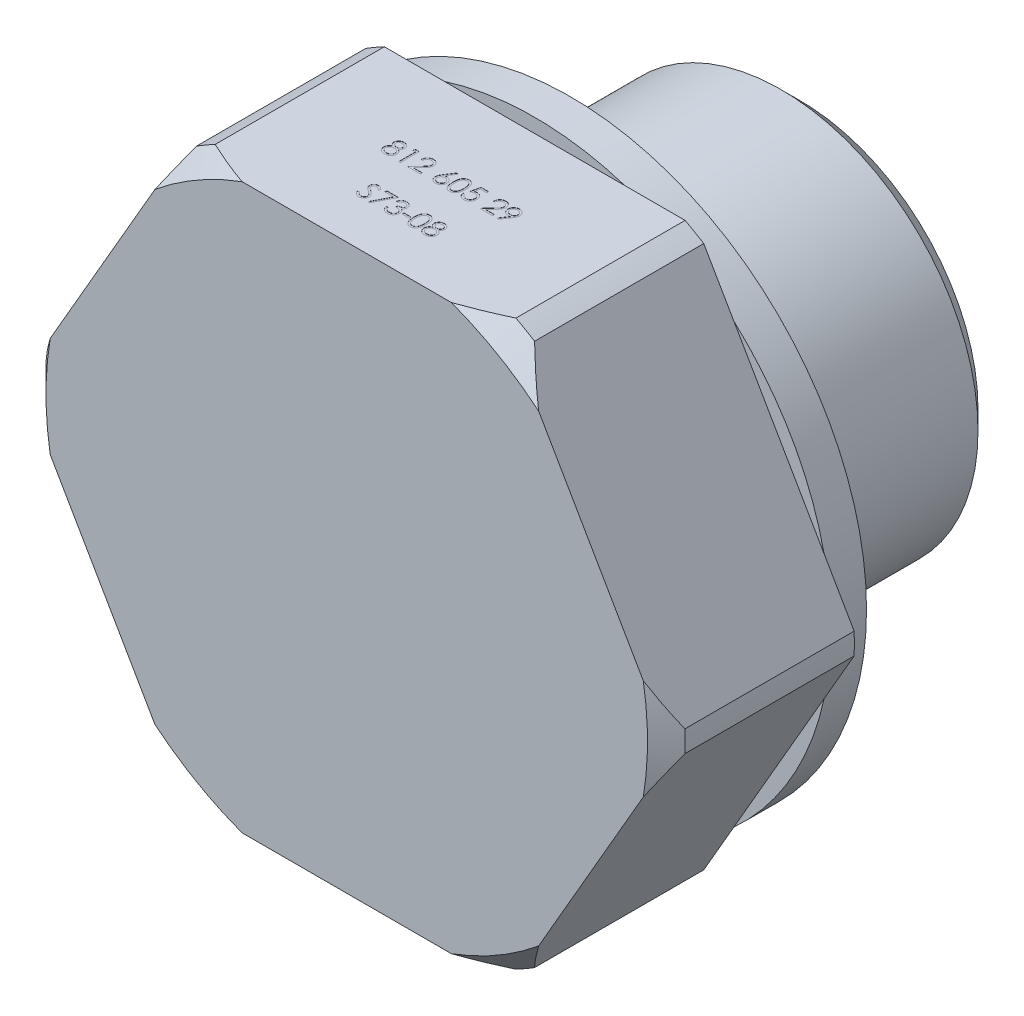
from build123d import *

# Parameters (mm, degrees)
SKETCH2_OUTSIDE_W  = 46.756
SKETCH2_OUTSIDE_H  = 46.756
EXTRUDE1_DEPTH     = 10
SKETCH3_W          = 1.9
SKETCH3_H          = 3
SKETCH4_R          = 1.2
SKETCH5_W          = 0.384615385
SKETCH5_H          = 0.102564102
CUT_EXTRUDE1_DEPTH = 0.01


with BuildPart() as part:
    # Sketch1 → Revolve1 (revolve)
    with BuildSketch(Plane(origin=(0, 0, 0), x_dir=(0, 0, -1), z_dir=(1, 0, 0)), mode=Mode.PRIVATE) as revolve1_sk:
        Polygon((0, 0), (0, 16), (1, 17), (10, 17), (10, 9.48), (12, 9.48), (12, 10.48), (23.1, 10.48), (24.1, 9.48), (24.1, 0), align=None)
    revolve(revolve1_sk.sketch.rotate(Axis((0, 0, 0), (0, 0, -1)), 90), axis=Axis((0, 0, 0), (0, 0, -1)))

    # Sketch2 outside → Extrude1 (cut)
    with BuildSketch(Plane.XY):
        Rectangle(SKETCH2_OUTSIDE_W, SKETCH2_OUTSIDE_H)
        Polygon((-8.660254038, 15), (-17.320508076, 0), (-8.660254038, -15), (8.660254038, -15), (17.320508076, 0), (8.660254038, 15), align=None, mode=Mode.SUBTRACT)
    extrude(amount=-EXTRUDE1_DEPTH, mode=Mode.SUBTRACT)

    # Sketch3 → Revolve2 (revolve)
    with BuildSketch(Plane(origin=(0, 0, 0), x_dir=(0, 0, -1), z_dir=(1, 0, 0)), mode=Mode.PRIVATE) as revolve2_sk:
        with Locations((10.95, 14.25)):
            Rectangle(SKETCH3_W, SKETCH3_H)
    revolve(revolve2_sk.sketch.rotate(Axis((0, 0, 0), (0, 0, -1)), 90), axis=Axis((0, 0, 0), (0, 0, -1)))

    # Sketch5 → Cut-Extrude1 (cut)
    # profile 1 of 14: a face of its own
    with BuildSketch(Plane(origin=(0, 15, 0), x_dir=(1, 0, 0), z_dir=(0, 1, 0))):
        with BuildLine():
            add(Edge.make_bspline(
                [(-2.91746869, 5.65216095), (-2.909283391, 5.647892963), (-2.893319324, 5.639568962), (-2.870582978, 5.626165868), (-2.849804407, 5.612039878), (-2.830407103, 5.597858204), (-2.81273186, 5.583077732), (-2.796976314, 5.567639688), (-2.782751279, 5.551929418), (-2.770343627, 5.535680892), (-2.759430245, 5.518937278), (-2.749998206, 5.501654628), (-2.741936148, 5.483870819), (-2.735546737, 5.465391724), (-2.730283368, 5.446488792), (-2.726661767, 5.426917941), (-2.724714076, 5.406808129), (-2.724345844, 5.393217185), (-2.724159395, 5.38633563)],
                knots=[0, 0, 0, 0, 1.272397273, 2.481599622, 3.635517121, 4.734568067, 5.792894095, 6.808321871, 7.773003508, 8.711915296, 9.623354172, 10.525449501, 11.423591555, 12.311487226, 13.218079475, 14.126165749, 15.051214107, 16, 16, 16, 16], degree=3))
            add(Edge.make_bspline(
                [(-2.724159395, 5.38633563), (-2.724379801, 5.376707706), (-2.724816067, 5.357650433), (-2.728616062, 5.329522972), (-2.734305485, 5.30220532), (-2.742613917, 5.275703466), (-2.753389171, 5.250163645), (-2.766668267, 5.225563995), (-2.78170004, 5.201501335), (-2.793772108, 5.186695792), (-2.799880549, 5.179204219)],
                knots=[0, 0, 0, 0, 1.025265484, 2.029385089, 3.018602448, 3.995076438, 4.983346944, 5.966715145, 6.97116228, 8, 8, 8, 8], degree=3))
            add(Edge.make_bspline(
                [(-2.799880549, 5.179204219), (-2.807833827, 5.170463141), (-2.823642103, 5.153089), (-2.85072294, 5.130531626), (-2.880443478, 5.111574656), (-2.912688716, 5.096125543), (-2.947372459, 5.084101012), (-2.984487317, 5.075460293), (-3.024105647, 5.070511027), (-3.051335781, 5.069795602), (-3.065305228, 5.069428578)],
                knots=[0, 0, 0, 0, 0.954267603, 1.896743057, 2.838368354, 3.796610408, 4.779680527, 5.799409237, 6.871065594, 8, 8, 8, 8], degree=3))
            add(Edge.make_bspline(
                [(-3.065305228, 5.069428578), (-3.078737625, 5.069757858), (-3.104875705, 5.070398602), (-3.142920813, 5.074739868), (-3.178384547, 5.08234783), (-3.211473109, 5.092760576), (-3.241987022, 5.106306355), (-3.269839336, 5.1231659), (-3.2954319, 5.142660598), (-3.317988035, 5.165350335), (-3.338013305, 5.189652584), (-3.355604177, 5.214724473), (-3.370225342, 5.240568289), (-3.382604512, 5.26679868), (-3.39208109, 5.293783295), (-3.398644579, 5.321383299), (-3.402812954, 5.349550482), (-3.403367564, 5.368559526), (-3.403646574, 5.378122488)],
                knots=[0, 0, 0, 0, 1.256902934, 2.445805442, 3.576955095, 4.645999104, 5.686449165, 6.692658513, 7.68621702, 8.689161843, 9.678783111, 10.630372946, 11.551080876, 12.453998257, 13.34127905, 14.221779781, 15.105423033, 16, 16, 16, 16], degree=3))
            add(Edge.make_bspline(
                [(-3.403646574, 5.378122488), (-3.403481466, 5.3851394), (-3.403155152, 5.399007295), (-3.400896624, 5.419495675), (-3.397265635, 5.439437428), (-3.392334362, 5.458906212), (-3.385651211, 5.477760289), (-3.377582031, 5.496088996), (-3.368172901, 5.513913024), (-3.357292568, 5.531329848), (-3.344634847, 5.548095423), (-3.330302376, 5.564494278), (-3.314008699, 5.580271954), (-3.295935082, 5.595621219), (-3.276288071, 5.610814354), (-3.254557348, 5.625030277), (-3.231318986, 5.639275409), (-3.214803156, 5.647792074), (-3.206330869, 5.65216095)],
                knots=[0, 0, 0, 0, 0.941657376, 1.861047343, 2.762797495, 3.66048619, 4.553285746, 5.444104102, 6.34607688, 7.256116206, 8.197091036, 9.162375105, 10.176350973, 11.237807142, 12.343728897, 13.50695164, 14.721116704, 16, 16, 16, 16], degree=3))
            add(Edge.make_bspline(
                [(-3.206330869, 5.65216095), (-3.217928405, 5.65848517), (-3.24038448, 5.670730629), (-3.270118606, 5.693229716), (-3.295658784, 5.717597663), (-3.316302989, 5.744349033), (-3.332552197, 5.77264814), (-3.34370037, 5.802317927), (-3.351242223, 5.832808245), (-3.351989316, 5.853638587), (-3.352364523, 5.864100053)],
                knots=[0, 0, 0, 0, 1.166880483, 2.259407225, 3.286803203, 4.280235371, 5.237608625, 6.161067461, 7.076446754, 8, 8, 8, 8], degree=3))
            add(Edge.make_bspline(
                [(-3.352364523, 5.864100053), (-3.351897259, 5.874756498), (-3.350957977, 5.896177811), (-3.343362743, 5.928065275), (-3.330985581, 5.959384294), (-3.31415101, 5.989983069), (-3.293183234, 6.018825987), (-3.268027078, 6.044694829), (-3.239283279, 6.067355253), (-3.207095317, 6.086377016), (-3.172456393, 6.101858062), (-3.135909043, 6.112537611), (-3.098090045, 6.119519359), (-3.072347839, 6.120309831), (-3.059295613, 6.12071063)],
                knots=[0, 0, 0, 0, 0.888701115, 1.786444228, 2.72001202, 3.692817113, 4.693886446, 5.687152267, 6.695133018, 7.739871481, 8.800368666, 9.853104506, 10.91144658, 12, 12, 12, 12], degree=3))
            add(Edge.make_bspline(
                [(-3.059295613, 6.12071063), (-3.046580237, 6.120297389), (-3.021506965, 6.119482525), (-2.984651357, 6.112686274), (-2.949387106, 6.101334982), (-2.915835821, 6.085935776), (-2.884598144, 6.066968078), (-2.856997485, 6.0439964), (-2.832616747, 6.018241671), (-2.812449777, 5.989407499), (-2.795831809, 5.958926301), (-2.784260123, 5.927034152), (-2.776845273, 5.894420135), (-2.775910026, 5.872352134), (-2.775441446, 5.861295565)],
                knots=[0, 0, 0, 0, 1.072916533, 2.115669174, 3.151510826, 4.193348718, 5.225979165, 6.227137561, 7.216255879, 8.211077061, 9.189680878, 10.138522389, 11.067357538, 12, 12, 12, 12], degree=3))
            add(Edge.make_bspline(
                [(-2.775441446, 5.861295565), (-2.775851321, 5.85044509), (-2.776656291, 5.829135373), (-2.783427702, 5.798070653), (-2.794831506, 5.768978642), (-2.810401267, 5.741529227), (-2.830694263, 5.716220228), (-2.855439616, 5.692729808), (-2.884440038, 5.670865), (-2.906228863, 5.658526038), (-2.91746869, 5.65216095)],
                knots=[0, 0, 0, 0, 0.975232327, 1.915300861, 2.843280834, 3.77672583, 4.742871857, 5.749627742, 6.839139064, 8, 8, 8, 8], degree=3))
        make_face()
        with BuildLine():
            add(Edge.make_bspline(
                [(-3.064303626, 6.018146527), (-3.071318142, 6.017960401), (-3.085041602, 6.017596257), (-3.10516408, 6.01569379), (-3.124299042, 6.011992871), (-3.142646413, 6.007067525), (-3.159954645, 6.000413814), (-3.176458804, 5.992586668), (-3.191878001, 5.983070649), (-3.206398373, 5.972396021), (-3.219470023, 5.960655191), (-3.231071323, 5.9484227), (-3.240707927, 5.935458302), (-3.248891102, 5.922084485), (-3.254828678, 5.907904321), (-3.259275622, 5.893352556), (-3.262281734, 5.878245303), (-3.262506988, 5.867920586), (-3.262620933, 5.862697809)],
                knots=[0, 0, 0, 0, 1.203892937, 2.355340988, 3.463153438, 4.544400666, 5.610487187, 6.640501085, 7.674077295, 8.714426146, 9.728707835, 10.68524104, 11.601827946, 12.495867327, 13.368432065, 14.231010473, 15.105153427, 16, 16, 16, 16], degree=3))
            add(Edge.make_bspline(
                [(-3.262620933, 5.862697809), (-3.262424543, 5.857474806), (-3.262036447, 5.847153403), (-3.259034982, 5.831911727), (-3.254561595, 5.816934116), (-3.247518549, 5.802576713), (-3.239071018, 5.788341467), (-3.228644882, 5.774584157), (-3.216219445, 5.761256904), (-3.202211605, 5.748473064), (-3.186951166, 5.736501989), (-3.170784296, 5.726109651), (-3.153913899, 5.717414191), (-3.136513307, 5.710177218), (-3.11840518, 5.704551522), (-3.099700473, 5.70056048), (-3.080396044, 5.69807991), (-3.067315878, 5.697783618), (-3.060697857, 5.697633706)],
                knots=[0, 0, 0, 0, 0.873023192, 1.725219244, 2.590779336, 3.480155217, 4.391973325, 5.357036234, 6.360879153, 7.436073238, 8.526419356, 9.601555421, 10.645666583, 11.697338044, 12.750135903, 13.812665442, 14.89329948, 16, 16, 16, 16], degree=3))
            add(Edge.make_bspline(
                [(-3.060697857, 5.697633706), (-3.052197827, 5.697883097), (-3.035281722, 5.698379415), (-3.01034477, 5.702994036), (-2.9860983, 5.71025287), (-2.96280147, 5.720184289), (-2.941057303, 5.732649392), (-2.921674426, 5.747573111), (-2.904818171, 5.764610853), (-2.890663711, 5.783497378), (-2.879689469, 5.803597831), (-2.871146096, 5.823769344), (-2.866157177, 5.844227124), (-2.865506444, 5.857931971), (-2.865185036, 5.864701014)],
                knots=[0, 0, 0, 0, 1.076279235, 2.141928126, 3.20205304, 4.278698113, 5.344010996, 6.36967002, 7.368914609, 8.37248503, 9.349703398, 10.264243087, 11.142681841, 12, 12, 12, 12], degree=3))
            add(Edge.make_bspline(
                [(-2.865185036, 5.864701014), (-2.865337007, 5.869451882), (-2.865638647, 5.878881672), (-2.868124377, 5.89280692), (-2.872231758, 5.906415372), (-2.877792638, 5.919819449), (-2.885109722, 5.932831087), (-2.893785204, 5.945654827), (-2.904323633, 5.958002188), (-2.916151186, 5.970160916), (-2.92956416, 5.981413494), (-2.944536706, 5.991309125), (-2.960992063, 5.999712656), (-2.97893062, 6.006538014), (-2.998286313, 6.0116644), (-3.018969991, 6.015503357), (-3.041154119, 6.017667103), (-3.056419762, 6.017983253), (-3.064303626, 6.018146527)],
                knots=[0, 0, 0, 0, 0.814439003, 1.616544685, 2.417341072, 3.248991801, 4.09997495, 4.973547432, 5.9003056, 6.880240646, 7.880314356, 8.896779544, 9.951930927, 11.043077905, 12.18215768, 13.381699519, 14.647792085, 16, 16, 16, 16], degree=3))
        make_face(mode=Mode.SUBTRACT)
        with BuildLine():
            add(Edge.make_bspline(
                [(-3.058494331, 5.595069604), (-3.067387412, 5.594911421), (-3.084833469, 5.594601104), (-3.110392591, 5.591146961), (-3.134922067, 5.586338563), (-3.158339192, 5.579044037), (-3.180634076, 5.569559326), (-3.201927414, 5.558149457), (-3.222056308, 5.544662188), (-3.240742802, 5.529268869), (-3.25780661, 5.512680454), (-3.272777553, 5.495119844), (-3.28549113, 5.476913406), (-3.295729202, 5.457829912), (-3.304132554, 5.438273451), (-3.309650804, 5.417756996), (-3.313188436, 5.396674963), (-3.313663474, 5.382343507), (-3.313902985, 5.375117681)],
                knots=[0, 0, 0, 0, 1.140299081, 2.23698856, 3.303958914, 4.344563908, 5.37730929, 6.408454204, 7.439741482, 8.480804886, 9.510774543, 10.48932336, 11.43758569, 12.353841022, 13.263987381, 14.161954604, 15.073269652, 16, 16, 16, 16], degree=3))
            add(Edge.make_bspline(
                [(-3.313902985, 5.375117681), (-3.313513482, 5.366137422), (-3.312740718, 5.348320798), (-3.30661025, 5.321988492), (-3.296771526, 5.296496762), (-3.283050035, 5.272053347), (-3.2660593, 5.249210459), (-3.245166024, 5.229299381), (-3.221668642, 5.21160753), (-3.194772112, 5.197298806), (-3.16539255, 5.185871704), (-3.13353777, 5.177998572), (-3.099664937, 5.172786729), (-3.076276482, 5.172261535), (-3.064303626, 5.171992681)],
                knots=[0, 0, 0, 0, 0.898778495, 1.783155532, 2.693654817, 3.627872908, 4.583023416, 5.533784346, 6.509005473, 7.520592997, 8.575161974, 9.658835044, 10.801527049, 12, 12, 12, 12], degree=3))
            add(Edge.make_bspline(
                [(-3.064303626, 5.171992681), (-3.054946378, 5.17217234), (-3.036715458, 5.172522375), (-3.010119473, 5.175612173), (-2.98502103, 5.180512066), (-2.961468802, 5.187638793), (-2.939199134, 5.196338787), (-2.918589604, 5.20753081), (-2.899110025, 5.220260045), (-2.881720275, 5.235362375), (-2.865882216, 5.251499374), (-2.852072704, 5.268582243), (-2.840084832, 5.28614671), (-2.830675987, 5.304589705), (-2.8231542, 5.323557395), (-2.817747471, 5.343224684), (-2.814411409, 5.363651894), (-2.81407401, 5.377508771), (-2.813902985, 5.384532745)],
                knots=[0, 0, 0, 0, 1.224942928, 2.386581632, 3.501229538, 4.569074225, 5.605009692, 6.626002462, 7.634866581, 8.645888296, 9.63523824, 10.59253846, 11.518950513, 12.414518923, 13.29783783, 14.186679152, 15.080837789, 16, 16, 16, 16], degree=3))
            add(Edge.make_bspline(
                [(-2.813902985, 5.384532745), (-2.814161799, 5.391354842), (-2.814672134, 5.404806826), (-2.817911189, 5.42474012), (-2.82360144, 5.443998067), (-2.831409267, 5.462812354), (-2.841803828, 5.480801769), (-2.854045219, 5.49843496), (-2.868814968, 5.515222516), (-2.885504281, 5.531294829), (-2.903692555, 5.546156468), (-2.923026025, 5.559303451), (-2.943355872, 5.570375484), (-2.964639075, 5.579380197), (-2.986828376, 5.586462331), (-3.009907456, 5.591409758), (-3.033903335, 5.59452393), (-3.050204726, 5.594885658), (-3.058494331, 5.595069604)],
                knots=[0, 0, 0, 0, 0.917430815, 1.809013306, 2.70690318, 3.612392954, 4.541220862, 5.495268465, 6.494511384, 7.542276156, 8.608045339, 9.649016899, 10.681629292, 11.715607085, 12.752076957, 13.808767841, 14.885711793, 16, 16, 16, 16], degree=3))
        make_face(mode=Mode.SUBTRACT)
    # profile 2 of 14: a face of its own
    with BuildSketch(Plane(origin=(0, 15, 0), x_dir=(1, 0, 0), z_dir=(0, 1, 0))):
        Polygon((-2.421875741, 6.095069604), (-2.236979908, 6.095069604), (-2.236979908, 5.095069604), (-2.326723498, 5.095069604), (-2.326723498, 5.992505501), (-2.480569651, 5.992505501), align=None)
    # profile 3 of 14: a face of its own
    with BuildSketch(Plane(origin=(0, 15, 0), x_dir=(1, 0, 0), z_dir=(0, 1, 0))):
        with BuildLine():
            Line((-1.736979908, 5.787377296), (-1.826723498, 5.787377296))
            add(Edge.make_bspline(
                [(-1.826723498, 5.787377296), (-1.826138597, 5.799283264), (-1.824989867, 5.822666268), (-1.819610356, 5.856758813), (-1.811912962, 5.889345898), (-1.80102969, 5.920165874), (-1.78751361, 5.949491247), (-1.771305031, 5.977205537), (-1.752106788, 6.00320302), (-1.730333435, 6.027242689), (-1.706685253, 6.049296281), (-1.68116927, 6.068340636), (-1.654356405, 6.084431399), (-1.626328006, 6.097883183), (-1.596767845, 6.107980282), (-1.565944171, 6.115472179), (-1.53372156, 6.119979706), (-1.511767268, 6.120464216), (-1.500601703, 6.12071063)],
                knots=[0, 0, 0, 0, 1.10065271, 2.161652631, 3.183658789, 4.190468796, 5.17591951, 6.163126047, 7.15150782, 8.156236427, 9.156009102, 10.134482811, 11.092018607, 12.041330605, 13.001268258, 13.972401359, 14.968799086, 16, 16, 16, 16], degree=3))
            add(Edge.make_bspline(
                [(-1.500601703, 6.12071063), (-1.489636539, 6.120453928), (-1.468090383, 6.119949518), (-1.436644093, 6.115617795), (-1.406707723, 6.10883334), (-1.37833979, 6.09931465), (-1.351766629, 6.086519099), (-1.326788616, 6.071148374), (-1.303108384, 6.053371279), (-1.28179216, 6.032441618), (-1.262218424, 6.01009808), (-1.245332065, 5.986244393), (-1.230871161, 5.961607454), (-1.218817538, 5.935999397), (-1.209944356, 5.909179103), (-1.203207725, 5.881537045), (-1.199399892, 5.852787099), (-1.198815486, 5.833328083), (-1.198518369, 5.823434988)],
                knots=[0, 0, 0, 0, 1.111607364, 2.184268762, 3.212621178, 4.221274766, 5.211760367, 6.196651075, 7.1921475, 8.207485113, 9.220403448, 10.201281604, 11.166441695, 12.114753415, 13.065576456, 14.026450734, 14.996634279, 16, 16, 16, 16], degree=3))
            add(Edge.make_bspline(
                [(-1.198518369, 5.823434988), (-1.199000268, 5.809506472), (-1.199955608, 5.781893863), (-1.208200095, 5.741264047), (-1.220937837, 5.701862602), (-1.236387274, 5.670154301), (-1.25199315, 5.644732331), (-1.265758806, 5.623613577), (-1.282230907, 5.601091744), (-1.301258739, 5.576939998), (-1.322555255, 5.551084464), (-1.346273732, 5.523514531), (-1.372595358, 5.494523015), (-1.391069124, 5.474721354), (-1.400641767, 5.46446063)],
                knots=[0, 0, 0, 0, 1.184203166, 2.347625244, 3.513805382, 4.700623107, 5.337941753, 6.051866363, 6.845199593, 7.711357327, 8.668078039, 9.695487809, 10.805859518, 12, 12, 12, 12], degree=3))
            Line((-1.400641767, 5.46446063), (-1.650842087, 5.197633706))
            Line((-1.650842087, 5.197633706), (-1.185697857, 5.197633706))
            Line((-1.185697857, 5.197633706), (-1.185697857, 5.095069604))
            Line((-1.185697857, 5.095069604), (-1.865185036, 5.095069604))
            Line((-1.865185036, 5.095069604), (-1.477364523, 5.508931783))
            add(Edge.make_bspline(
                [(-1.477364523, 5.508931783), (-1.46792227, 5.518788442), (-1.449785634, 5.537721067), (-1.424133469, 5.565361913), (-1.401093758, 5.591004639), (-1.38051736, 5.614600795), (-1.362850644, 5.636495529), (-1.347172863, 5.65597973), (-1.334611266, 5.673909573), (-1.320978296, 5.694692606), (-1.307774301, 5.720067553), (-1.296427914, 5.751077179), (-1.289509386, 5.782999251), (-1.288679433, 5.804571262), (-1.288261959, 5.815422168)],
                knots=[0, 0, 0, 0, 1.329631726, 2.553950428, 3.673215718, 4.687767853, 5.603093632, 6.413772471, 7.123043292, 7.734684054, 8.834405432, 9.900288307, 10.943827018, 12, 12, 12, 12], degree=3))
            add(Edge.make_bspline(
                [(-1.288261959, 5.815422168), (-1.2884436, 5.822245425), (-1.288801579, 5.835692753), (-1.291960921, 5.855408684), (-1.296735351, 5.874427203), (-1.303576853, 5.892806808), (-1.312607351, 5.910362709), (-1.323599745, 5.927116275), (-1.33628262, 5.943313122), (-1.350954411, 5.958499778), (-1.367071988, 5.972408694), (-1.384098917, 5.984729861), (-1.402113232, 5.99502675), (-1.421038982, 6.003467749), (-1.440823401, 6.010089287), (-1.461504757, 6.014677452), (-1.483025905, 6.017558162), (-1.497721189, 6.017947926), (-1.505209074, 6.018146527)],
                knots=[0, 0, 0, 0, 0.991446411, 1.95395049, 2.89581595, 3.838931463, 4.798493298, 5.75982156, 6.748411868, 7.785213223, 8.824556874, 9.840280684, 10.836137867, 11.835679398, 12.848801643, 13.863922112, 14.911575587, 16, 16, 16, 16], degree=3))
            add(Edge.make_bspline(
                [(-1.505209074, 6.018146527), (-1.513029312, 6.017942232), (-1.528386968, 6.01754103), (-1.550935264, 6.014734555), (-1.572445486, 6.009892886), (-1.592971744, 6.003270979), (-1.612548768, 5.994854251), (-1.631081352, 5.984370896), (-1.648527892, 5.971861326), (-1.664921184, 5.95767831), (-1.680025178, 5.941887567), (-1.693295714, 5.92428472), (-1.704891147, 5.905191173), (-1.715008071, 5.884658444), (-1.723223982, 5.862500221), (-1.729502025, 5.838795163), (-1.734469696, 5.813646197), (-1.736129273, 5.79627903), (-1.736979908, 5.787377296)],
                knots=[0, 0, 0, 0, 1.031018746, 2.02475058, 2.990194455, 3.934040569, 4.864654155, 5.795059489, 6.735614925, 7.690564532, 8.649604399, 9.611025574, 10.590972636, 11.591080095, 12.624614302, 13.701020113, 14.821632451, 16, 16, 16, 16], degree=3))
        make_face()
    # profile 4 of 14: a face of its own
    with BuildSketch(Plane(origin=(0, 15, 0), x_dir=(1, 0, 0), z_dir=(0, 1, 0))):
        with BuildLine():
            Line((-0.249800421, 6.12071063), (-0.180489523, 6.066423771))
            Line((-0.180489523, 6.066423771), (-0.44471228, 5.662377296))
            add(Edge.make_bspline(
                [(-0.44471228, 5.662377296), (-0.427120772, 5.665181256), (-0.392806547, 5.670650698), (-0.358073433, 5.671552968), (-0.341146574, 5.671992681)],
                knots=[0, 0, 0, 0, 1.025318673, 2, 2, 2, 2], degree=3))
            add(Edge.make_bspline(
                [(-0.341146574, 5.671992681), (-0.330982493, 5.671723462), (-0.311040976, 5.671195267), (-0.281739709, 5.667021101), (-0.253577597, 5.660524036), (-0.226617465, 5.651015185), (-0.200825097, 5.638872319), (-0.176053007, 5.624318176), (-0.152766712, 5.606602316), (-0.130666377, 5.586812315), (-0.110601492, 5.564893181), (-0.092836904, 5.541635655), (-0.077914964, 5.517063975), (-0.065808129, 5.491190585), (-0.056406735, 5.464055368), (-0.049553122, 5.435693042), (-0.04550181, 5.40608405), (-0.04495167, 5.385947429), (-0.044672216, 5.375718642)],
                knots=[0, 0, 0, 0, 1.044136307, 2.048553127, 3.035567123, 4.010001674, 4.980053131, 5.96154148, 6.956538004, 7.981742224, 9.006487041, 10.005615874, 10.984750588, 11.954802044, 12.935714515, 13.930994945, 14.949008866, 16, 16, 16, 16], degree=3))
            add(Edge.make_bspline(
                [(-0.044672216, 5.375718642), (-0.045078817, 5.361724441), (-0.045878912, 5.334187165), (-0.053851425, 5.294079535), (-0.066239895, 5.255870245), (-0.083947761, 5.220169339), (-0.105942727, 5.187025747), (-0.132764896, 5.157658471), (-0.163463036, 5.131467032), (-0.19817355, 5.109565141), (-0.235528682, 5.091678555), (-0.27477211, 5.078831343), (-0.315522723, 5.07092178), (-0.343181183, 5.06993018), (-0.357172216, 5.069428578)],
                knots=[0, 0, 0, 0, 1.031375318, 2.029502543, 3.004789286, 3.987476834, 4.960371455, 5.9300674, 6.912260825, 7.929083631, 8.949397511, 9.960523116, 10.96833055, 12, 12, 12, 12], degree=3))
            add(Edge.make_bspline(
                [(-0.357172216, 5.069428578), (-0.370628416, 5.069865208), (-0.397282792, 5.070730096), (-0.436492162, 5.07843465), (-0.47416731, 5.090922394), (-0.510044276, 5.108126473), (-0.543278737, 5.129857297), (-0.573011776, 5.156017948), (-0.59909514, 5.186049224), (-0.620802174, 5.219946466), (-0.638018955, 5.256372168), (-0.650930362, 5.294354213), (-0.658472146, 5.333754208), (-0.659526019, 5.360463105), (-0.660056831, 5.373915758)],
                knots=[0, 0, 0, 0, 1.012016664, 2.004627821, 2.994792927, 3.992885782, 4.990978636, 5.973936114, 6.964471063, 7.975201453, 8.993600317, 9.990122807, 10.98767138, 12, 12, 12, 12], degree=3))
            add(Edge.make_bspline(
                [(-0.660056831, 5.373915758), (-0.659719275, 5.38421421), (-0.659030051, 5.405241682), (-0.654217654, 5.437088547), (-0.646484855, 5.469674571), (-0.637824785, 5.497318626), (-0.62867461, 5.519964775), (-0.621059599, 5.538222915), (-0.611581315, 5.557011793), (-0.601474634, 5.576975689), (-0.589829815, 5.597600099), (-0.5771682, 5.619229718), (-0.563139729, 5.641520555), (-0.553305397, 5.656647468), (-0.548277985, 5.664380501)],
                knots=[0, 0, 0, 0, 1.173818275, 2.396712641, 3.66331629, 4.989737886, 5.693666774, 6.447286557, 7.243889047, 8.091586357, 8.998013824, 9.943181721, 10.948533338, 12, 12, 12, 12], degree=3))
            Line((-0.548277985, 5.664380501), (-0.249800421, 6.12071063))
        make_face()
        with BuildLine():
            add(Edge.make_bspline(
                [(-0.359976703, 5.569428578), (-0.367594243, 5.56920333), (-0.382539795, 5.568761395), (-0.404439498, 5.566265473), (-0.425109887, 5.561535987), (-0.44478842, 5.555419552), (-0.463265052, 5.547086942), (-0.480768836, 5.537102107), (-0.497098313, 5.5251394), (-0.51217377, 5.511634853), (-0.525834977, 5.496835625), (-0.537601419, 5.480987879), (-0.547750571, 5.464469357), (-0.556002547, 5.447143135), (-0.562428276, 5.429015551), (-0.567076349, 5.410170054), (-0.569663135, 5.390480252), (-0.570093487, 5.377128108), (-0.570313241, 5.370309988)],
                knots=[0, 0, 0, 0, 1.128956033, 2.215002439, 3.259141796, 4.2666399, 5.263148119, 6.255916712, 7.247353359, 8.256307737, 9.250603402, 10.226115518, 11.176314381, 12.118911324, 13.063945463, 14.021379252, 14.989639887, 16, 16, 16, 16], degree=3))
            add(Edge.make_bspline(
                [(-0.570313241, 5.370309988), (-0.570134281, 5.363552851), (-0.569783366, 5.350303111), (-0.566596989, 5.330777632), (-0.561729822, 5.311987658), (-0.554489709, 5.294030058), (-0.545853456, 5.27663111), (-0.534451934, 5.260421029), (-0.521818567, 5.244415294), (-0.506717443, 5.229843445), (-0.490510768, 5.21628441), (-0.473196139, 5.204432909), (-0.455150436, 5.194294002), (-0.43613003, 5.186347974), (-0.416404777, 5.179826749), (-0.395810333, 5.175237755), (-0.374332374, 5.172643319), (-0.359783249, 5.172212407), (-0.352364523, 5.171992681)],
                knots=[0, 0, 0, 0, 0.989467248, 1.94019797, 2.891935182, 3.827694429, 4.772920941, 5.730924762, 6.725747692, 7.756678648, 8.79901574, 9.819492441, 10.826891316, 11.826466727, 12.835195252, 13.867842842, 14.912794438, 16, 16, 16, 16], degree=3))
            add(Edge.make_bspline(
                [(-0.352364523, 5.171992681), (-0.344945809, 5.172212424), (-0.330396708, 5.17264337), (-0.308918577, 5.175237561), (-0.288324771, 5.179827461), (-0.268597197, 5.186345395), (-0.24958536, 5.194303569), (-0.231555439, 5.204369832), (-0.214404556, 5.216357294), (-0.198187241, 5.229820274), (-0.183148973, 5.244498232), (-0.170212608, 5.260278152), (-0.159160256, 5.276762122), (-0.150179059, 5.293961519), (-0.14301869, 5.311998516), (-0.138126843, 5.330774723), (-0.134947046, 5.350303873), (-0.134595227, 5.363553109), (-0.134415805, 5.370309988)],
                knots=[0, 0, 0, 0, 1.087397944, 2.132534446, 3.165364764, 4.174271784, 5.174024072, 6.181601208, 7.194203697, 8.236725232, 9.267838612, 10.269026844, 11.221737037, 12.171628256, 13.107553087, 14.05945871, 15.010357665, 16, 16, 16, 16], degree=3))
            add(Edge.make_bspline(
                [(-0.134415805, 5.370309988), (-0.134573032, 5.377137003), (-0.134881617, 5.390536211), (-0.138371885, 5.41016125), (-0.143212574, 5.429111292), (-0.150521972, 5.447267339), (-0.160018278, 5.464557369), (-0.171584387, 5.481070161), (-0.184967391, 5.496926707), (-0.200414985, 5.511672785), (-0.217230872, 5.525056138), (-0.234996908, 5.537147017), (-0.253823663, 5.546993999), (-0.273371452, 5.555447893), (-0.293875721, 5.561439034), (-0.315112507, 5.566280239), (-0.337283041, 5.56874053), (-0.35235984, 5.569197643), (-0.359976703, 5.569428578)],
                knots=[0, 0, 0, 0, 0.978753431, 1.920974676, 2.853199117, 3.782215702, 4.721507756, 5.67862441, 6.671401678, 7.694929396, 8.738190014, 9.75360867, 10.774035531, 11.783329636, 12.805060902, 13.835252836, 14.906360638, 16, 16, 16, 16], degree=3))
        make_face(mode=Mode.SUBTRACT)
    # profile 5 of 14: a face of its own
    with BuildSketch(Plane(origin=(0, 15, 0), x_dir=(1, 0, 0), z_dir=(0, 1, 0))):
        with BuildLine():
            add(Edge.make_bspline(
                [(0.057891887, 5.594668963), (0.057985607, 5.610696788), (0.058167658, 5.641831069), (0.060192921, 5.68719811), (0.063557305, 5.729758192), (0.068167983, 5.769513354), (0.073778834, 5.806473858), (0.081268973, 5.840540932), (0.089786917, 5.871872248), (0.099659044, 5.900569976), (0.110798412, 5.927020748), (0.122922487, 5.951713663), (0.136512428, 5.974611358), (0.150791546, 5.996079298), (0.166337852, 6.015766068), (0.182708935, 6.033949686), (0.200543757, 6.0502099), (0.219236045, 6.065023129), (0.238955035, 6.078008693), (0.259138654, 6.089446618), (0.279925827, 6.099218009), (0.301373308, 6.10690099), (0.323288324, 6.113246947), (0.345747486, 6.117586646), (0.368787876, 6.120317191), (0.384339714, 6.120578239), (0.392226823, 6.12071063)],
                knots=[0, 0, 0, 0, 1.646270934, 3.197905019, 4.663502075, 6.030701355, 7.308322542, 8.50163776, 9.611534131, 10.641858119, 11.616356847, 12.558055219, 13.465016945, 14.349605745, 15.204443733, 16.039544428, 16.859896111, 17.680448484, 18.487036065, 19.28249412, 20.06191084, 20.843045899, 21.620316918, 22.403196591, 23.190181807, 24, 24, 24, 24], degree=3))
            add(Edge.make_bspline(
                [(0.392226823, 6.12071063), (0.400179817, 6.120571254), (0.415995819, 6.120294079), (0.439378784, 6.117630096), (0.46222155, 6.113209775), (0.484426732, 6.106946639), (0.506176729, 6.099176446), (0.527301416, 6.089437269), (0.547932011, 6.07810045), (0.567740665, 6.064779342), (0.586944841, 6.049927264), (0.60507283, 6.03313793), (0.622126283, 6.014580867), (0.638319228, 5.99445462), (0.653192255, 5.972373167), (0.667356093, 5.948720565), (0.680033818, 5.923083175), (0.692243725, 5.895888755), (0.702782864, 5.866384853), (0.712287505, 5.834737778), (0.719967211, 5.800573725), (0.726364146, 5.76407194), (0.73131983, 5.725098374), (0.734929156, 5.683736569), (0.736835752, 5.639959315), (0.73719481, 5.610028501), (0.737379067, 5.594668963)],
                knots=[0, 0, 0, 0, 0.810914788, 1.612654377, 2.396697861, 3.181598691, 3.963628158, 4.749916497, 5.551656086, 6.361998678, 7.18212741, 8.025565596, 8.878627764, 9.750805457, 10.657531673, 11.591944965, 12.560506719, 13.57287815, 14.630710178, 15.753379473, 16.941251878, 18.199788006, 19.531962791, 20.947069417, 22.433333509, 24, 24, 24, 24], degree=3))
            add(Edge.make_bspline(
                [(0.737379067, 5.594668963), (0.7371929, 5.579376418), (0.736830161, 5.549579517), (0.73495053, 5.505999239), (0.731248064, 5.46485694), (0.726616639, 5.426053951), (0.720202078, 5.389751774), (0.712314888, 5.355824789), (0.703557653, 5.324126483), (0.692747711, 5.294916537), (0.68091608, 5.267787473), (0.668043167, 5.242454002), (0.654251788, 5.218692204), (0.639226432, 5.196692276), (0.623211171, 5.176298374), (0.605863232, 5.157870482), (0.587671636, 5.140964576), (0.568410946, 5.125921254), (0.54829336, 5.112754167), (0.527733623, 5.100978781), (0.506366942, 5.091483725), (0.484677527, 5.083330856), (0.462355137, 5.077102156), (0.439427597, 5.07279534), (0.416011529, 5.069774812), (0.400182511, 5.069544389), (0.392226823, 5.069428578)],
                knots=[0, 0, 0, 0, 1.561518951, 3.042555995, 4.452378317, 5.7783523, 7.031515105, 8.214008947, 9.334062868, 10.386615937, 11.391082383, 12.354592575, 13.286541444, 14.194233754, 15.072674879, 15.931287219, 16.775624067, 17.606195743, 18.42308326, 19.229000347, 20.022332153, 20.807536673, 21.593273796, 22.3848459, 23.188221202, 24, 24, 24, 24], degree=3))
            add(Edge.make_bspline(
                [(0.392226823, 5.069428578), (0.384339933, 5.069561823), (0.368788526, 5.069824555), (0.345744976, 5.072542764), (0.323378564, 5.076912907), (0.30157892, 5.083031937), (0.280234201, 5.09052189), (0.259635262, 5.100280086), (0.239553067, 5.111518391), (0.220041193, 5.124317083), (0.20146629, 5.138980421), (0.183723832, 5.155198789), (0.167259541, 5.173376907), (0.151935513, 5.193227742), (0.137371488, 5.214568668), (0.123974524, 5.237691061), (0.111582852, 5.262503235), (0.10025614, 5.289165495), (0.090213665, 5.318066903), (0.081342891, 5.349538097), (0.074338846, 5.38385685), (0.068343716, 5.420747526), (0.063508178, 5.460368649), (0.060206942, 5.502741729), (0.058166566, 5.54784036), (0.057985118, 5.578774581), (0.057891887, 5.594668963)],
                knots=[0, 0, 0, 0, 0.810891512, 1.598919785, 2.382837074, 3.152667961, 3.926044502, 4.706494248, 5.493654104, 6.291793342, 7.103789334, 7.925228297, 8.761435821, 9.622817696, 10.50288917, 11.416980706, 12.369136599, 13.353924996, 14.394355917, 15.514179734, 16.714354668, 17.994756427, 19.357759367, 20.818452758, 22.365282078, 24, 24, 24, 24], degree=3))
        make_face()
        with BuildLine():
            add(Edge.make_bspline(
                [(0.147635477, 5.595069604), (0.147669605, 5.581712833), (0.14773584, 5.555789963), (0.149466183, 5.51812046), (0.151823392, 5.48298608), (0.154863763, 5.450342212), (0.159378891, 5.420299352), (0.164437973, 5.392650871), (0.17059457, 5.367543089), (0.177878861, 5.344803714), (0.186175746, 5.324046838), (0.195234564, 5.304732205), (0.204966199, 5.286631651), (0.215857385, 5.269907763), (0.227718831, 5.254506002), (0.24028262, 5.240153764), (0.254017644, 5.227354627), (0.273018713, 5.212004097), (0.29810342, 5.196141487), (0.329709264, 5.182328319), (0.362185965, 5.173647617), (0.384229179, 5.172543687), (0.395231631, 5.171992681)],
                knots=[0, 0, 0, 0, 1.459021318, 2.831673884, 4.118529203, 5.306027144, 6.411944654, 7.436330062, 8.375795394, 9.233974572, 10.042671642, 10.816086306, 11.563610507, 12.285937304, 12.993564865, 13.685989202, 14.367179055, 15.041617293, 16.353048772, 17.594441528, 18.799311195, 20, 20, 20, 20], degree=3))
            add(Edge.make_bspline(
                [(0.395231631, 5.171992681), (0.406305251, 5.17244919), (0.428429629, 5.173361265), (0.460753571, 5.182160904), (0.492133648, 5.195437915), (0.516725631, 5.211137202), (0.535434929, 5.226088154), (0.548839783, 5.238835196), (0.561143226, 5.253108301), (0.57281239, 5.2685081), (0.583514983, 5.28532881), (0.593247308, 5.303489545), (0.602128264, 5.323040739), (0.607187992, 5.336689236), (0.6097749, 5.34366736)],
                knots=[0, 0, 0, 0, 1.353760809, 2.704726607, 4.075137775, 5.516104923, 6.260822281, 7.007110065, 7.778089737, 8.566572457, 9.372053459, 10.217411131, 11.088608312, 12, 12, 12, 12], degree=3))
            add(Edge.make_bspline(
                [(0.6097749, 5.34366736), (0.612789691, 5.352590143), (0.618911009, 5.370707218), (0.626800087, 5.398811119), (0.633013058, 5.428297623), (0.638602592, 5.458990514), (0.64241775, 5.491116142), (0.645488554, 5.524575109), (0.647297322, 5.559392641), (0.647521536, 5.583048353), (0.647635477, 5.595069604)],
                knots=[0, 0, 0, 0, 0.884706709, 1.796334032, 2.740027952, 3.714592787, 4.726048262, 5.777819803, 6.87074269, 8, 8, 8, 8], degree=3))
            add(Edge.make_bspline(
                [(0.647635477, 5.595069604), (0.64747828, 5.60708891), (0.647170769, 5.630601243), (0.645995344, 5.665035009), (0.642960037, 5.697740084), (0.63958886, 5.728857361), (0.634618226, 5.758214591), (0.629258852, 5.786057535), (0.622058506, 5.812041257), (0.614367142, 5.836572566), (0.605564171, 5.859372753), (0.595873962, 5.88054812), (0.585524888, 5.900200899), (0.574284248, 5.918277168), (0.562285481, 5.934857894), (0.549211895, 5.949610635), (0.535582075, 5.962992626), (0.51649145, 5.978267646), (0.491498796, 5.993842416), (0.46040004, 6.008175491), (0.428036998, 6.016406431), (0.406158869, 6.017566913), (0.395231631, 6.018146527)],
                knots=[0, 0, 0, 0, 1.31362396, 2.569729283, 3.763502607, 4.902122613, 5.988968491, 7.01645872, 7.998833611, 8.933434873, 9.825090667, 10.667526885, 11.477055099, 12.250526234, 12.991942729, 13.710640831, 14.402115721, 15.076753259, 16.378508321, 17.609869233, 18.806226677, 20, 20, 20, 20], degree=3))
            add(Edge.make_bspline(
                [(0.395231631, 6.018146527), (0.384171461, 6.017566114), (0.362030974, 6.01640423), (0.329331559, 6.008206157), (0.297987458, 5.993916738), (0.273060894, 5.97821606), (0.253956955, 5.963262257), (0.240504757, 5.950294699), (0.227891565, 5.936110055), (0.216272222, 5.920566651), (0.205389569, 5.90386226), (0.195394994, 5.88586547), (0.186390043, 5.86648508), (0.178080176, 5.845737527), (0.170773665, 5.823000114), (0.164746818, 5.797923259), (0.159179089, 5.770362719), (0.155237583, 5.740157145), (0.151733653, 5.707505101), (0.149481839, 5.67228301), (0.147730051, 5.63455033), (0.147667633, 5.608493428), (0.147635477, 5.595069604)],
                knots=[0, 0, 0, 0, 1.207732386, 2.417664972, 3.655092373, 4.956220595, 5.625982001, 6.301752483, 6.994047911, 7.697131622, 8.419323945, 9.170223765, 9.943494443, 10.752040957, 11.610060368, 12.549350801, 13.567764191, 14.679664412, 15.874934091, 17.154273443, 18.533957287, 20, 20, 20, 20], degree=3))
        make_face(mode=Mode.SUBTRACT)
    # profile 6 of 14: a face of its own
    with BuildSketch(Plane(origin=(0, 15, 0), x_dir=(1, 0, 0), z_dir=(0, 1, 0))):
        with BuildLine():
            Line((1.455327784, 6.095069604), (1.455327784, 5.992505501))
            Line((1.455327784, 5.992505501), (1.115383874, 5.992505501))
            Line((1.115383874, 5.992505501), (1.061297336, 5.729484668))
            add(Edge.make_bspline(
                [(1.061297336, 5.729484668), (1.071884728, 5.732407603), (1.092396127, 5.738070327), (1.122670373, 5.74435769), (1.151411003, 5.748147817), (1.170061109, 5.748665334), (1.179085797, 5.748915758)],
                knots=[0, 0, 0, 0, 1.100273476, 2.13160584, 3.095893838, 4, 4, 4, 4], degree=3))
            add(Edge.make_bspline(
                [(1.179085797, 5.748915758), (1.19025258, 5.748674062), (1.212209265, 5.748198827), (1.244334678, 5.743635442), (1.275001219, 5.736452609), (1.304144754, 5.726418174), (1.331819197, 5.713586822), (1.357769929, 5.697558267), (1.382386475, 5.678834459), (1.405227216, 5.657307312), (1.425948447, 5.633615422), (1.444167301, 5.608141744), (1.459642327, 5.581133841), (1.472088257, 5.552333667), (1.482026638, 5.522059623), (1.488641494, 5.489993171), (1.493046268, 5.456436565), (1.493538378, 5.433492402), (1.493789323, 5.42179236)],
                knots=[0, 0, 0, 0, 1.052922333, 2.070308379, 3.05430497, 4.020497103, 4.973039431, 5.925935799, 6.892292201, 7.88610001, 8.88166317, 9.857072816, 10.836096531, 11.812156883, 12.81219415, 13.836441305, 14.89672472, 16, 16, 16, 16], degree=3))
            add(Edge.make_bspline(
                [(1.493789323, 5.42179236), (1.493599301, 5.413643154), (1.493221826, 5.397454872), (1.49130223, 5.373413672), (1.487606311, 5.349881434), (1.482644104, 5.326855036), (1.476203413, 5.304378073), (1.468406541, 5.282386208), (1.458864819, 5.26101632), (1.448398711, 5.240066207), (1.436614003, 5.220009491), (1.42353443, 5.201252638), (1.409715718, 5.183514272), (1.394846751, 5.166984634), (1.378789324, 5.151772343), (1.361737905, 5.137787119), (1.343828556, 5.124792454), (1.324784201, 5.113315826), (1.305029206, 5.102754982), (1.284278287, 5.094091114), (1.263003801, 5.086345249), (1.240899551, 5.080171098), (1.218015605, 5.075333225), (1.19431424, 5.072047339), (1.169919763, 5.069654072), (1.153384045, 5.069504255), (1.14503131, 5.069428578)],
                knots=[0, 0, 0, 0, 1.056347294, 2.098418968, 3.122841568, 4.141288669, 5.149314143, 6.15115421, 7.162517403, 8.180376062, 9.185164535, 10.17417709, 11.141909838, 12.097768115, 13.052685741, 14.0056014, 14.954263652, 15.917497458, 16.885230207, 17.854509472, 18.828990115, 19.81800267, 20.826176721, 21.857883937, 22.917946725, 24, 24, 24, 24], degree=3))
            add(Edge.make_bspline(
                [(1.14503131, 5.069428578), (1.135067259, 5.069625961), (1.115464164, 5.070014287), (1.086744002, 5.074076711), (1.059111258, 5.079894973), (1.032788371, 5.088648193), (1.007539439, 5.099615991), (0.983704377, 5.113477755), (0.960674155, 5.12918607), (0.939385002, 5.147723314), (0.919626112, 5.167984937), (0.901938538, 5.189972835), (0.886186088, 5.213324104), (0.872621017, 5.238152148), (0.861050154, 5.264391728), (0.851960157, 5.292141157), (0.844623484, 5.321255444), (0.84151965, 5.341299304), (0.839943169, 5.35147986)],
                knots=[0, 0, 0, 0, 1.0467383, 2.05933395, 3.04377827, 4.011590433, 4.970194871, 5.932262533, 6.905835911, 7.896367577, 8.894135286, 9.877477877, 10.858688626, 11.851381753, 12.8477658, 13.868841284, 14.917554742, 16, 16, 16, 16], degree=3))
            Line((0.839943169, 5.35147986), (0.929686759, 5.35147986))
            add(Edge.make_bspline(
                [(0.929686759, 5.35147986), (0.931894918, 5.341943731), (0.936139123, 5.323614761), (0.945455051, 5.297862949), (0.956845301, 5.2749146), (0.970389401, 5.254466147), (0.986546552, 5.236635005), (1.004983532, 5.220744416), (1.02565431, 5.206408665), (1.048623804, 5.194459303), (1.072856113, 5.18426823), (1.098218173, 5.177482032), (1.124019414, 5.172710348), (1.141470377, 5.172232702), (1.150239643, 5.171992681)],
                knots=[0, 0, 0, 0, 1.136247022, 2.183929868, 3.172523383, 4.106158343, 5.02341133, 5.958108904, 6.928429099, 7.938127109, 8.96079061, 9.975095812, 10.982467395, 12, 12, 12, 12], degree=3))
            add(Edge.make_bspline(
                [(1.150239643, 5.171992681), (1.158799199, 5.172227189), (1.175653034, 5.172688937), (1.200456287, 5.17624294), (1.224402823, 5.181716532), (1.247256353, 5.189907919), (1.269416793, 5.199863553), (1.290323585, 5.212639289), (1.31058155, 5.227342151), (1.329561016, 5.244186903), (1.346943716, 5.262749673), (1.362302608, 5.282600357), (1.375096012, 5.303776599), (1.385877186, 5.325911785), (1.394063842, 5.349248516), (1.399904123, 5.373677423), (1.403333568, 5.399258846), (1.403805334, 5.41670722), (1.404045733, 5.42559845)],
                knots=[0, 0, 0, 0, 1.027316725, 2.022795036, 3.002884548, 3.971462791, 4.93288096, 5.914575861, 6.907176829, 7.935150275, 8.956128384, 9.956726525, 10.942570165, 11.921478529, 12.907843606, 13.90538589, 14.932640048, 16, 16, 16, 16], degree=3))
            add(Edge.make_bspline(
                [(1.404045733, 5.42559845), (1.403857596, 5.433620093), (1.403489345, 5.449321319), (1.40048061, 5.472292521), (1.39524719, 5.494027676), (1.387983224, 5.514631742), (1.378760508, 5.534124155), (1.367490133, 5.552525029), (1.35396059, 5.569591838), (1.338505765, 5.585332568), (1.321574896, 5.599859675), (1.302876684, 5.6122437), (1.282802419, 5.622661962), (1.261593962, 5.631652819), (1.238746848, 5.638110174), (1.214713525, 5.642958142), (1.189234465, 5.645762531), (1.171814269, 5.646151642), (1.162859836, 5.646351655)],
                knots=[0, 0, 0, 0, 1.045622112, 2.046656509, 3.013763289, 3.955457236, 4.890082067, 5.820317437, 6.762574623, 7.722996705, 8.69280354, 9.665887285, 10.63943826, 11.638615906, 12.663482002, 13.728887084, 14.832589034, 16, 16, 16, 16], degree=3))
            add(Edge.make_bspline(
                [(1.162859836, 5.646351655), (1.155108713, 5.646185772), (1.139104612, 5.645843265), (1.114555233, 5.643321409), (1.088757598, 5.639253039), (1.061810599, 5.633656968), (1.033633311, 5.626333804), (1.004285196, 5.617558232), (0.973704549, 5.607066232), (0.953099485, 5.599142743), (0.942507272, 5.595069604)],
                knots=[0, 0, 0, 0, 0.817624296, 1.688186739, 2.600797293, 3.572016777, 4.590301741, 5.671205678, 6.80286297, 8, 8, 8, 8], degree=3))
            Line((0.942507272, 5.595069604), (1.045071374, 6.095069604))
            Line((1.045071374, 6.095069604), (1.455327784, 6.095069604))
        make_face()
    # profile 7 of 14: a face of its own
    with BuildSketch(Plane(origin=(0, 15, 0), x_dir=(1, 0, 0), z_dir=(0, 1, 0))):
        with BuildLine():
            Line((2.109173938, 5.787377296), (2.019430349, 5.787377296))
            add(Edge.make_bspline(
                [(2.019430349, 5.787377296), (2.020015249, 5.799283264), (2.021163979, 5.822666268), (2.02654349, 5.856758813), (2.034240884, 5.889345898), (2.045124156, 5.920165874), (2.058640236, 5.949491247), (2.074848815, 5.977205537), (2.094047058, 6.00320302), (2.115820411, 6.027242689), (2.139468593, 6.049296281), (2.164984576, 6.068340636), (2.191797441, 6.084431399), (2.219825841, 6.097883183), (2.249386002, 6.107980282), (2.280209675, 6.115472179), (2.312432286, 6.119979706), (2.334386578, 6.120464216), (2.345552143, 6.12071063)],
                knots=[0, 0, 0, 0, 1.10065271, 2.161652631, 3.183658789, 4.190468796, 5.17591951, 6.163126047, 7.15150782, 8.156236427, 9.156009102, 10.134482811, 11.092018607, 12.041330605, 13.001268258, 13.972401359, 14.968799086, 16, 16, 16, 16], degree=3))
            add(Edge.make_bspline(
                [(2.345552143, 6.12071063), (2.356517307, 6.120453928), (2.378063463, 6.119949518), (2.409509753, 6.115617795), (2.439446123, 6.10883334), (2.467814056, 6.09931465), (2.494387217, 6.086519099), (2.51936523, 6.071148374), (2.543045462, 6.053371279), (2.564361686, 6.032441618), (2.583935423, 6.01009808), (2.600821781, 5.986244393), (2.615282685, 5.961607454), (2.627336308, 5.935999397), (2.63620949, 5.909179103), (2.642946121, 5.881537045), (2.646753954, 5.852787099), (2.64733836, 5.833328083), (2.647635477, 5.823434988)],
                knots=[0, 0, 0, 0, 1.111607364, 2.184268762, 3.212621178, 4.221274766, 5.211760367, 6.196651075, 7.1921475, 8.207485113, 9.220403448, 10.201281604, 11.166441695, 12.114753415, 13.065576456, 14.026450734, 14.996634279, 16, 16, 16, 16], degree=3))
            add(Edge.make_bspline(
                [(2.647635477, 5.823434988), (2.647153578, 5.809506472), (2.646198238, 5.781893863), (2.637953751, 5.741264047), (2.625216009, 5.701862602), (2.609766572, 5.670154301), (2.594160696, 5.644732331), (2.58039504, 5.623613577), (2.563922939, 5.601091744), (2.544895107, 5.576939998), (2.523598591, 5.551084464), (2.499880114, 5.523514531), (2.473558488, 5.494523015), (2.455084722, 5.474721354), (2.445512079, 5.46446063)],
                knots=[0, 0, 0, 0, 1.184203166, 2.347625244, 3.513805382, 4.700623107, 5.337941753, 6.051866363, 6.845199593, 7.711357327, 8.668078039, 9.695487809, 10.805859518, 12, 12, 12, 12], degree=3))
            Line((2.445512079, 5.46446063), (2.195311759, 5.197633706))
            Line((2.195311759, 5.197633706), (2.66045599, 5.197633706))
            Line((2.66045599, 5.197633706), (2.66045599, 5.095069604))
            Line((2.66045599, 5.095069604), (1.98096881, 5.095069604))
            Line((1.98096881, 5.095069604), (2.368789323, 5.508931783))
            add(Edge.make_bspline(
                [(2.368789323, 5.508931783), (2.378231576, 5.518788442), (2.396368213, 5.537721067), (2.422020377, 5.565361913), (2.445060088, 5.591004639), (2.465636486, 5.614600795), (2.483303202, 5.636495529), (2.498980983, 5.65597973), (2.51154258, 5.673909573), (2.52517555, 5.694692606), (2.538379545, 5.720067553), (2.549725932, 5.751077179), (2.556644461, 5.782999251), (2.557474414, 5.804571262), (2.557891887, 5.815422168)],
                knots=[0, 0, 0, 0, 1.329631726, 2.553950428, 3.673215718, 4.687767853, 5.603093632, 6.413772471, 7.123043292, 7.734684054, 8.834405432, 9.900288307, 10.943827018, 12, 12, 12, 12], degree=3))
            add(Edge.make_bspline(
                [(2.557891887, 5.815422168), (2.557710246, 5.822245425), (2.557352268, 5.835692753), (2.554192925, 5.855408684), (2.549418495, 5.874427203), (2.542576993, 5.892806808), (2.533546496, 5.910362709), (2.522554101, 5.927116275), (2.509871226, 5.943313122), (2.495199435, 5.958499778), (2.479081858, 5.972408694), (2.462054929, 5.984729861), (2.444040614, 5.99502675), (2.425114865, 6.003467749), (2.405330445, 6.010089287), (2.384649089, 6.014677452), (2.363127942, 6.017558162), (2.348432657, 6.017947926), (2.340944772, 6.018146527)],
                knots=[0, 0, 0, 0, 0.991446411, 1.95395049, 2.89581595, 3.838931463, 4.798493298, 5.75982156, 6.748411868, 7.785213223, 8.824556874, 9.840280684, 10.836137867, 11.835679398, 12.848801643, 13.863922112, 14.911575587, 16, 16, 16, 16], degree=3))
            add(Edge.make_bspline(
                [(2.340944772, 6.018146527), (2.333124534, 6.017942232), (2.317766878, 6.01754103), (2.295218583, 6.014734555), (2.27370836, 6.009892886), (2.253182102, 6.003270979), (2.233605078, 5.994854251), (2.215072494, 5.984370896), (2.197625954, 5.971861326), (2.181232662, 5.95767831), (2.166128668, 5.941887567), (2.152858132, 5.92428472), (2.141262699, 5.905191173), (2.131145775, 5.884658444), (2.122929864, 5.862500221), (2.116651821, 5.838795163), (2.11168415, 5.813646197), (2.110024573, 5.79627903), (2.109173938, 5.787377296)],
                knots=[0, 0, 0, 0, 1.031018746, 2.02475058, 2.990194455, 3.934040569, 4.864654155, 5.795059489, 6.735614925, 7.690564532, 8.649604399, 9.611025574, 10.590972636, 11.591080095, 12.624614302, 13.701020113, 14.821632451, 16, 16, 16, 16], degree=3))
        make_face()
    # profile 8 of 14: a face of its own
    with BuildSketch(Plane(origin=(0, 15, 0), x_dir=(1, 0, 0), z_dir=(0, 1, 0))):
        with BuildLine():
            Line((2.968148297, 5.069428578), (2.896433554, 5.119308386))
            Line((2.896433554, 5.119308386), (3.174478426, 5.525758706))
            add(Edge.make_bspline(
                [(3.174478426, 5.525758706), (3.156738215, 5.52358926), (3.121806752, 5.519317498), (3.086624723, 5.51853274), (3.069310156, 5.518146527)],
                knots=[0, 0, 0, 0, 1.015715272, 2, 2, 2, 2], degree=3))
            add(Edge.make_bspline(
                [(3.069310156, 5.518146527), (3.058812428, 5.518415406), (3.038206306, 5.518943192), (3.007911549, 5.523126566), (2.978801388, 5.529569459), (2.950953001, 5.539183389), (2.924261714, 5.551131449), (2.898785796, 5.565947739), (2.874559541, 5.583378108), (2.851843138, 5.603330391), (2.831182642, 5.625238406), (2.812775985, 5.648425733), (2.797478519, 5.673161724), (2.784770923, 5.698941787), (2.775133651, 5.726136459), (2.768115783, 5.754436287), (2.76379511, 5.784039613), (2.763281083, 5.804189651), (2.763020092, 5.814420565)],
                knots=[0, 0, 0, 0, 1.060718605, 2.082097864, 3.085795603, 4.069760067, 5.054557537, 6.03741023, 7.043284206, 8.066802108, 9.088538119, 10.083643548, 11.053783639, 12.022749082, 12.983451788, 13.964007469, 14.966251758, 16, 16, 16, 16], degree=3))
            add(Edge.make_bspline(
                [(2.763020092, 5.814420565), (2.763515645, 5.828411609), (2.764488315, 5.855873189), (2.772316462, 5.895997123), (2.785190845, 5.933936136), (2.80314181, 5.969590477), (2.82575173, 6.00244726), (2.852925613, 6.032049719), (2.884498174, 6.057976821), (2.91975018, 6.0802637), (2.957851043, 6.098187985), (2.997756374, 6.111399213), (3.039160408, 6.119170284), (3.067208314, 6.120194816), (3.081329387, 6.12071063)],
                knots=[0, 0, 0, 0, 1.022988612, 2.007919123, 2.978103895, 3.94594894, 4.918897164, 5.887013414, 6.875921846, 7.89917871, 8.930658928, 9.948724884, 10.967259574, 12, 12, 12, 12], degree=3))
            add(Edge.make_bspline(
                [(3.081329387, 6.12071063), (3.095183221, 6.120187726), (3.122557092, 6.119154517), (3.162811094, 6.111587669), (3.20136567, 6.098834334), (3.238007095, 6.081210173), (3.271932641, 6.059118485), (3.302440016, 6.032794335), (3.328833027, 6.002221327), (3.351068421, 5.968138902), (3.368917004, 5.931519764), (3.381794799, 5.893295786), (3.389722125, 5.853741866), (3.390721075, 5.826943445), (3.39122522, 5.813418963)],
                knots=[0, 0, 0, 0, 1.026385292, 2.028040595, 3.023318987, 4.028184125, 5.03290303, 6.015178782, 7.004435299, 8.016004309, 9.023023918, 10.015172535, 10.998308025, 12, 12, 12, 12], degree=3))
            add(Edge.make_bspline(
                [(3.39122522, 5.813418963), (3.390888532, 5.802920744), (3.390205644, 5.781627732), (3.385423842, 5.749276206), (3.377303789, 5.71629014), (3.368089018, 5.688369684), (3.359194113, 5.665310127), (3.350822361, 5.64709539), (3.341533175, 5.6279236), (3.330699242, 5.607995789), (3.319052871, 5.587057922), (3.305893078, 5.565320004), (3.291520057, 5.542752863), (3.281282994, 5.527539409), (3.276040926, 5.519749091)],
                knots=[0, 0, 0, 0, 1.179839688, 2.393009684, 3.667231171, 4.993948276, 5.694988576, 6.444077775, 7.246288328, 8.089075292, 8.993003841, 9.939041771, 10.944649915, 12, 12, 12, 12], degree=3))
            Line((3.276040926, 5.519749091), (2.968148297, 5.069428578))
        make_face()
        with BuildLine():
            add(Edge.make_bspline(
                [(3.085936759, 5.62071063), (3.093889334, 5.620927882), (3.109370295, 5.621350799), (3.132049523, 5.623924868), (3.153456439, 5.628488864), (3.173648224, 5.635037353), (3.192827339, 5.642939258), (3.210689147, 5.652999826), (3.227248597, 5.665004579), (3.242616576, 5.678493155), (3.256263433, 5.693479036), (3.268418585, 5.709163923), (3.278750176, 5.725616669), (3.286911112, 5.743043315), (3.293620991, 5.761019661), (3.298254709, 5.779835191), (3.300821661, 5.799391877), (3.301259254, 5.812677207), (3.301481631, 5.819428578)],
                knots=[0, 0, 0, 0, 1.163407946, 2.26475976, 3.333800367, 4.359385343, 5.366239384, 6.363380779, 7.350133999, 8.353570782, 9.349036268, 10.310270964, 11.253520213, 12.184142, 13.120487599, 14.056272588, 15.012232024, 16, 16, 16, 16], degree=3))
            add(Edge.make_bspline(
                [(3.301481631, 5.819428578), (3.301290297, 5.826182768), (3.300913249, 5.839492728), (3.297888307, 5.859078368), (3.292566814, 5.877847871), (3.285426676, 5.895903994), (3.276020894, 5.913098386), (3.264734183, 5.929646921), (3.251324912, 5.945444672), (3.235895607, 5.960120096), (3.219257164, 5.973648067), (3.201525592, 5.985586946), (3.182847045, 5.995593002), (3.163335476, 6.00384985), (3.142950234, 6.010293215), (3.12170338, 6.014926748), (3.09948755, 6.017490106), (3.084407182, 6.017924933), (3.076722015, 6.018146527)],
                knots=[0, 0, 0, 0, 0.972161553, 1.915763587, 2.844109794, 3.775983486, 4.705125789, 5.659731448, 6.655561913, 7.682237399, 8.721216875, 9.739758359, 10.754845918, 11.767244016, 12.7857855, 13.828538656, 14.893392813, 16, 16, 16, 16], degree=3))
            add(Edge.make_bspline(
                [(3.076722015, 6.018146527), (3.069103686, 6.017924575), (3.054156586, 6.017489107), (3.032138255, 6.01493162), (3.011035064, 6.010262053), (2.990708887, 6.003852835), (2.971197898, 5.995592386), (2.952520231, 5.985586421), (2.934784512, 5.973650815), (2.918162021, 5.960109451), (2.902705472, 5.945512981), (2.889526749, 5.929577716), (2.878214208, 5.913106994), (2.86882135, 5.895901706), (2.861677774, 5.877848482), (2.856357202, 5.859078203), (2.853332012, 5.839492771), (2.852954999, 5.826182783), (2.852763682, 5.819428578)],
                knots=[0, 0, 0, 0, 1.099389452, 2.15699305, 3.192601482, 4.213358962, 5.227959689, 6.245255729, 7.266013209, 8.307253147, 9.336162325, 10.327954924, 11.284637477, 12.215801273, 13.149702402, 14.080068371, 15.025723358, 16, 16, 16, 16], degree=3))
            add(Edge.make_bspline(
                [(2.852763682, 5.819428578), (2.852936804, 5.81267195), (2.853278231, 5.799346643), (2.856571886, 5.779767673), (2.862079966, 5.760999618), (2.869456934, 5.742859987), (2.879171674, 5.725525171), (2.891092774, 5.709077353), (2.905065787, 5.693330081), (2.920903926, 5.678528021), (2.938237687, 5.664941685), (2.956751043, 5.653075862), (2.976125282, 5.643055163), (2.996428605, 5.635014768), (3.017510548, 5.628554292), (3.039560585, 5.623933279), (3.062505796, 5.621375489), (3.078051505, 5.620934376), (3.085936759, 5.62071063)],
                knots=[0, 0, 0, 0, 0.952633368, 1.87876736, 2.791047057, 3.707742249, 4.635551637, 5.587206343, 6.568248508, 7.601284464, 8.641511608, 9.671105535, 10.699146789, 11.713763218, 12.747829548, 13.806491675, 14.887386225, 16, 16, 16, 16], degree=3))
        make_face(mode=Mode.SUBTRACT)
    # profile 9 of 14: a face of its own
    with BuildSketch(Plane(origin=(0, 15, 0), x_dir=(1, 0, 0), z_dir=(0, 1, 0))):
        with BuildLine():
            Line((-2.070313241, 2.621311591), (-1.985777985, 2.671992681))
            add(Edge.make_bspline(
                [(-1.985777985, 2.671992681), (-1.977915631, 2.658831428), (-1.962851665, 2.633614975), (-1.937722706, 2.59954125), (-1.911684731, 2.570580633), (-1.884544921, 2.546901603), (-1.856468936, 2.528259064), (-1.827273492, 2.515058426), (-1.797056975, 2.50682529), (-1.776493026, 2.505825265), (-1.766226703, 2.505326014)],
                knots=[0, 0, 0, 0, 1.272034388, 2.437168799, 3.508375237, 4.49857839, 5.41946034, 6.295179144, 7.148887113, 8, 8, 8, 8], degree=3))
            add(Edge.make_bspline(
                [(-1.766226703, 2.505326014), (-1.757459028, 2.505570206), (-1.740077093, 2.506054318), (-1.714487881, 2.510705975), (-1.689635937, 2.517852298), (-1.666033469, 2.52808685), (-1.644006151, 2.540469274), (-1.624689952, 2.555425325), (-1.607991063, 2.572169955), (-1.594331316, 2.590850714), (-1.583851306, 2.610941328), (-1.575796429, 2.631563028), (-1.571326408, 2.653039762), (-1.57065305, 2.667499894), (-1.570313241, 2.674797168)],
                knots=[0, 0, 0, 0, 1.095163259, 2.171163733, 3.241058638, 4.321873601, 5.38011039, 6.391990106, 7.366004449, 8.327778327, 9.272591725, 10.192022065, 11.087607919, 12, 12, 12, 12], degree=3))
            add(Edge.make_bspline(
                [(-1.570313241, 2.674797168), (-1.570734473, 2.683123125), (-1.571590775, 2.700048579), (-1.578828341, 2.725019908), (-1.59021384, 2.749732071), (-1.600717452, 2.765018147), (-1.606170613, 2.772954219)],
                knots=[0, 0, 0, 0, 0.938893495, 1.908633276, 2.914225137, 4, 4, 4, 4], degree=3))
            add(Edge.make_bspline(
                [(-1.606170613, 2.772954219), (-1.610647931, 2.778681883), (-1.620047501, 2.790706397), (-1.63620679, 2.808605036), (-1.655168537, 2.827067441), (-1.676283839, 2.8467986), (-1.700321864, 2.866880828), (-1.726529725, 2.888271764), (-1.755576542, 2.910157929), (-1.775947827, 2.924835805), (-1.786459074, 2.932409347)],
                knots=[0, 0, 0, 0, 0.722233717, 1.516239348, 2.393582979, 3.351407094, 4.387010283, 5.505090956, 6.712668013, 8, 8, 8, 8], degree=3))
            add(Edge.make_bspline(
                [(-1.786459074, 2.932409347), (-1.796980216, 2.93990323), (-1.817095838, 2.954230962), (-1.845226862, 2.975495043), (-1.870382423, 2.994936148), (-1.892450713, 3.012737295), (-1.911422026, 3.028900896), (-1.927445858, 3.043271736), (-1.940114017, 3.056238468), (-1.947158469, 3.064650279), (-1.950321254, 3.068426976)],
                knots=[0, 0, 0, 0, 1.452282411, 2.77665338, 3.964542531, 5.026858415, 5.96415736, 6.766646006, 7.446254459, 8, 8, 8, 8], degree=3))
            add(Edge.make_bspline(
                [(-1.950321254, 3.068426976), (-1.954741981, 3.074312986), (-1.963435935, 3.085888616), (-1.974911936, 3.103981432), (-1.984665983, 3.122502365), (-1.992312363, 3.141501184), (-1.998751283, 3.160711163), (-2.00308212, 3.180382948), (-2.005793948, 3.200428267), (-2.006071658, 3.213917839), (-2.006210677, 3.220670565)],
                knots=[0, 0, 0, 0, 1.068054152, 2.10047183, 3.106115577, 4.101338837, 5.06977816, 6.043150881, 7.020423561, 8, 8, 8, 8], degree=3))
            add(Edge.make_bspline(
                [(-2.006210677, 3.220670565), (-2.00583776, 3.231250501), (-2.005099897, 3.252184233), (-1.99885975, 3.282764471), (-1.989010351, 3.31196059), (-1.975211812, 3.339483542), (-1.957423997, 3.36461668), (-1.936839433, 3.387649105), (-1.912321865, 3.407011557), (-1.885421116, 3.423929288), (-1.855976438, 3.437170981), (-1.825121894, 3.447159832), (-1.792808445, 3.45281962), (-1.770921835, 3.453631839), (-1.759816446, 3.454043963)],
                knots=[0, 0, 0, 0, 1.005424448, 1.989358655, 2.955360095, 3.929531133, 4.905563448, 5.876582895, 6.856512386, 7.866279853, 8.892233794, 9.918561126, 10.94386622, 12, 12, 12, 12], degree=3))
            add(Edge.make_bspline(
                [(-1.759816446, 3.454043963), (-1.748032418, 3.45363752), (-1.724597746, 3.452829233), (-1.690126541, 3.445801367), (-1.656937765, 3.434172604), (-1.630239689, 3.420975845), (-1.609344615, 3.40779544), (-1.593409548, 3.395789776), (-1.577261705, 3.381968316), (-1.560770832, 3.366294246), (-1.544216358, 3.348623746), (-1.527352515, 3.329077835), (-1.510139867, 3.307775962), (-1.499066764, 3.292568961), (-1.493390164, 3.28477313)],
                knots=[0, 0, 0, 0, 1.286793592, 2.559021753, 3.825965368, 5.121522368, 5.803751409, 6.523245864, 7.299691795, 8.125521123, 9.008227632, 9.944561021, 10.946284179, 12, 12, 12, 12], degree=3))
            Line((-1.493390164, 3.28477313), (-1.574519972, 3.223274732))
            add(Edge.make_bspline(
                [(-1.574519972, 3.223274732), (-1.57941881, 3.229585786), (-1.588852826, 3.241739402), (-1.603175537, 3.258759778), (-1.61667515, 3.274307343), (-1.629975265, 3.287811665), (-1.642373445, 3.300012275), (-1.654406886, 3.31045792), (-1.665902415, 3.319250947), (-1.68039296, 3.328634821), (-1.698598023, 3.337936679), (-1.721450747, 3.345807845), (-1.74533254, 3.350537862), (-1.761598149, 3.351163259), (-1.769832472, 3.35147986)],
                knots=[0, 0, 0, 0, 1.181633172, 2.275549214, 3.290209073, 4.226197932, 5.078386478, 5.862611352, 6.581680152, 7.217281963, 8.414376989, 9.595101626, 10.782541182, 12, 12, 12, 12], degree=3))
            add(Edge.make_bspline(
                [(-1.769832472, 3.35147986), (-1.780162907, 3.35113366), (-1.800084178, 3.350466046), (-1.828367102, 3.343174622), (-1.853822509, 3.33169409), (-1.875694671, 3.315604097), (-1.893905236, 3.296540956), (-1.907078224, 3.27460414), (-1.915006842, 3.250380596), (-1.915974351, 3.23348298), (-1.916467087, 3.224877296)],
                knots=[0, 0, 0, 0, 1.14458467, 2.207223713, 3.21896685, 4.227309161, 5.202851033, 6.127160689, 7.046193047, 8, 8, 8, 8], degree=3))
            add(Edge.make_bspline(
                [(-1.916467087, 3.224877296), (-1.916354765, 3.219519731), (-1.916129938, 3.20879584), (-1.912994281, 3.192952576), (-1.908965902, 3.177149336), (-1.902582293, 3.16145717), (-1.893769349, 3.145601639), (-1.882196441, 3.129309714), (-1.867621209, 3.112437797), (-1.856456349, 3.101464262), (-1.850561639, 3.095670565)],
                knots=[0, 0, 0, 0, 0.858281714, 1.717966888, 2.583508476, 3.4729293, 4.427298488, 5.488583878, 6.674047936, 8, 8, 8, 8], degree=3))
            add(Edge.make_bspline(
                [(-1.850561639, 3.095670565), (-1.848372675, 3.093717129), (-1.843172199, 3.089076213), (-1.833664791, 3.081478418), (-1.821109706, 3.072106198), (-1.805834792, 3.060509822), (-1.787558402, 3.047057975), (-1.766278529, 3.031922657), (-1.742232377, 3.014612526), (-1.725168972, 3.002510372), (-1.716146574, 2.996111271)],
                knots=[0, 0, 0, 0, 0.420754252, 0.999615792, 1.744751191, 2.668019286, 3.750313428, 4.999500688, 6.413464383, 8, 8, 8, 8], degree=3))
            add(Edge.make_bspline(
                [(-1.716146574, 2.996111271), (-1.705293456, 2.988213739), (-1.684277897, 2.972921264), (-1.654375732, 2.949945356), (-1.627263215, 2.927474565), (-1.602845157, 2.905652391), (-1.580880326, 2.884644365), (-1.561612406, 2.864197742), (-1.544845069, 2.844459007), (-1.526793863, 2.819152557), (-1.508348772, 2.788072247), (-1.492508341, 2.74999275), (-1.482520242, 2.71176523), (-1.481214095, 2.686071848), (-1.480569651, 2.673394924)],
                knots=[0, 0, 0, 0, 1.163667725, 2.253281268, 3.268753668, 4.215851969, 5.092017293, 5.902905408, 6.650798638, 7.335211899, 8.59617414, 9.77448103, 10.901945474, 12, 12, 12, 12], degree=3))
            add(Edge.make_bspline(
                [(-1.480569651, 2.673394924), (-1.480757405, 2.664429677), (-1.481129267, 2.646673282), (-1.485403813, 2.620600403), (-1.491666575, 2.595277297), (-1.501105785, 2.571016979), (-1.512626687, 2.547375619), (-1.527245615, 2.524973361), (-1.544190668, 2.50331439), (-1.563628886, 2.48297625), (-1.584899144, 2.464305908), (-1.6073802, 2.447697605), (-1.631108849, 2.433849513), (-1.655956368, 2.422549272), (-1.681928464, 2.413711124), (-1.709016403, 2.407307447), (-1.737264834, 2.403377244), (-1.756464972, 2.402969312), (-1.766226703, 2.402761912)],
                knots=[0, 0, 0, 0, 0.983748083, 1.948392443, 2.894712957, 3.844097841, 4.80183111, 5.778335162, 6.776009319, 7.81870978, 8.863265674, 9.881300176, 10.883814829, 11.87499822, 12.874611388, 13.892143829, 14.928324115, 16, 16, 16, 16], degree=3))
            add(Edge.make_bspline(
                [(-1.766226703, 2.402761912), (-1.773779658, 2.402907963), (-1.788790446, 2.403198228), (-1.810993156, 2.405764308), (-1.832747324, 2.409394909), (-1.853779976, 2.415158929), (-1.874362093, 2.422152351), (-1.89440416, 2.430763303), (-1.91391589, 2.441082504), (-1.933006628, 2.452881082), (-1.951627821, 2.466611866), (-1.969604812, 2.482604294), (-1.987527436, 2.500417295), (-2.004866692, 2.520534599), (-2.021973305, 2.542631194), (-2.038509993, 2.566913818), (-2.054819056, 2.593250205), (-2.065052046, 2.611783086), (-2.070313241, 2.621311591)],
                knots=[0, 0, 0, 0, 0.915332311, 1.819136955, 2.706846663, 3.586547465, 4.459518054, 5.340707479, 6.227863349, 7.133153174, 8.059268498, 9.028702269, 10.047606654, 11.120612155, 12.245963614, 13.433783089, 14.680604001, 16, 16, 16, 16], degree=3))
        make_face()
    # profile 10 of 14: a face of its own
    with BuildSketch(Plane(origin=(0, 15, 0), x_dir=(1, 0, 0), z_dir=(0, 1, 0))):
        Polygon((-1.301082472, 3.428402937), (-0.685697857, 3.428402937), (-1.211338882, 2.402761912), (-1.288862921, 2.445430181), (-0.837741126, 3.325838835), (-1.301082472, 3.325838835), align=None)
    # profile 11 of 14: a face of its own
    with BuildSketch(Plane(origin=(0, 15, 0), x_dir=(1, 0, 0), z_dir=(0, 1, 0))):
        with BuildLine():
            Line((-0.467749139, 3.197633706), (-0.557492728, 3.197633706))
            add(Edge.make_bspline(
                [(-0.557492728, 3.197633706), (-0.555061428, 3.20770013), (-0.550308435, 3.227379166), (-0.540394843, 3.255495526), (-0.529595055, 3.282102247), (-0.51662674, 3.306701125), (-0.502481382, 3.329786526), (-0.48627489, 3.350834847), (-0.468754969, 3.370381408), (-0.449376412, 3.387728048), (-0.429053937, 3.40343597), (-0.407501189, 3.416828844), (-0.385151791, 3.42835003), (-0.361850895, 3.437841525), (-0.337529132, 3.444991675), (-0.312406383, 3.450179334), (-0.286416811, 3.453548223), (-0.268774642, 3.453877013), (-0.259816446, 3.454043963)],
                knots=[0, 0, 0, 0, 1.162005537, 2.271625781, 3.343758855, 4.383309926, 5.390229558, 6.379919256, 7.361854164, 8.333198761, 9.295911338, 10.242430842, 11.177959212, 12.116337295, 13.062827104, 14.020064771, 14.994644689, 16, 16, 16, 16], degree=3))
            add(Edge.make_bspline(
                [(-0.259816446, 3.454043963), (-0.246764234, 3.453649897), (-0.220944517, 3.452870361), (-0.183012218, 3.445751951), (-0.146433127, 3.434487627), (-0.111607627, 3.418923705), (-0.079259504, 3.39972733), (-0.050477736, 3.376880262), (-0.025652447, 3.350823319), (-0.004825482, 3.322042586), (0.011481661, 3.291283869), (0.023506339, 3.259626682), (0.030826819, 3.227146118), (0.031775549, 3.205215467), (0.032250861, 3.194228258)],
                knots=[0, 0, 0, 0, 1.083050992, 2.142477498, 3.193116406, 4.255571735, 5.30263384, 6.308962982, 7.297363603, 8.282367274, 9.249857812, 10.179914175, 11.08814088, 12, 12, 12, 12], degree=3))
            add(Edge.make_bspline(
                [(0.032250861, 3.194228258), (0.031918407, 3.183654888), (0.031267845, 3.162964444), (0.025743929, 3.132758302), (0.016447854, 3.104289273), (0.003570779, 3.077437512), (-0.013098236, 3.052373272), (-0.033290435, 3.029040161), (-0.057148338, 3.007334687), (-0.075228035, 2.994900552), (-0.084535998, 2.988499091)],
                knots=[0, 0, 0, 0, 1.024540389, 2.004866551, 2.965041327, 3.920577974, 4.882998113, 5.874504559, 6.905732034, 8, 8, 8, 8], degree=3))
            add(Edge.make_bspline(
                [(-0.084535998, 2.988499091), (-0.073898353, 2.983362471), (-0.052822104, 2.97318534), (-0.024093381, 2.953226552), (0.001986012, 2.930181881), (0.016529932, 2.912198266), (0.0238374, 2.903162553)],
                knots=[0, 0, 0, 0, 1.015518401, 2.012035669, 3.001164323, 4, 4, 4, 4], degree=3))
            add(Edge.make_bspline(
                [(0.0238374, 2.903162553), (0.028649212, 2.896574624), (0.038194039, 2.883506647), (0.04997562, 2.86249624), (0.060663939, 2.841252957), (0.068992573, 2.819207413), (0.075442249, 2.796615123), (0.080052544, 2.773437296), (0.082916584, 2.749655004), (0.083326742, 2.733565724), (0.083532913, 2.725478258)],
                knots=[0, 0, 0, 0, 1.025084078, 2.033381695, 3.024893161, 4.013698104, 4.991890475, 5.976764909, 6.982997093, 8, 8, 8, 8], degree=3))
            add(Edge.make_bspline(
                [(0.083532913, 2.725478258), (0.083020195, 2.71147548), (0.081997171, 2.683535823), (0.07285315, 2.642257331), (0.058677938, 2.601907187), (0.038547385, 2.563314376), (0.014013811, 2.527205696), (-0.015173996, 2.494898179), (-0.048684398, 2.467127149), (-0.086057441, 2.443924227), (-0.126548049, 2.425376249), (-0.169855361, 2.412502694), (-0.215355376, 2.404118122), (-0.246557461, 2.403219017), (-0.262420613, 2.402761912)],
                knots=[0, 0, 0, 0, 0.955779014, 1.907060117, 2.875433937, 3.871313158, 4.872415639, 5.851225146, 6.836215519, 7.83643374, 8.849228613, 9.86973379, 10.916971861, 12, 12, 12, 12], degree=3))
            add(Edge.make_bspline(
                [(-0.262420613, 2.402761912), (-0.273111842, 2.403009972), (-0.294148614, 2.403498074), (-0.325075328, 2.406834817), (-0.354595814, 2.412929104), (-0.382749985, 2.421130048), (-0.409562852, 2.431527689), (-0.434952597, 2.444475889), (-0.459075423, 2.459707746), (-0.481703695, 2.477403057), (-0.502834714, 2.497197726), (-0.521906921, 2.519443157), (-0.539238291, 2.54372813), (-0.554364759, 2.570334717), (-0.567975317, 2.598919076), (-0.579169876, 2.629847219), (-0.589022895, 2.662842653), (-0.593603885, 2.685836294), (-0.595954267, 2.697633706)],
                knots=[0, 0, 0, 0, 1.048658725, 2.063410685, 3.046034179, 4.001477787, 4.936774919, 5.862367409, 6.792675028, 7.730719943, 8.675894397, 9.627829632, 10.600096036, 11.597688215, 12.626045268, 13.701542398, 14.82072376, 16, 16, 16, 16], degree=3))
            Line((-0.595954267, 2.697633706), (-0.506210677, 2.697633706))
            add(Edge.make_bspline(
                [(-0.506210677, 2.697633706), (-0.503872594, 2.689933988), (-0.499324819, 2.674957368), (-0.491583591, 2.653402995), (-0.482764084, 2.633643551), (-0.473302782, 2.615534088), (-0.463366083, 2.598896258), (-0.452247533, 2.58417001), (-0.440770634, 2.570708524), (-0.432119391, 2.563124349), (-0.427885357, 2.559412553)],
                knots=[0, 0, 0, 0, 1.198163088, 2.33053128, 3.407730985, 4.417276592, 5.372219308, 6.28897303, 7.162600585, 8, 8, 8, 8], degree=3))
            add(Edge.make_bspline(
                [(-0.427885357, 2.559412553), (-0.422286335, 2.555095886), (-0.411105574, 2.546475877), (-0.392886079, 2.535475411), (-0.373724683, 2.52594369), (-0.353206205, 2.518662634), (-0.331773413, 2.512497588), (-0.30907988, 2.508463154), (-0.285325818, 2.505695105), (-0.269106457, 2.505450839), (-0.260818049, 2.505326014)],
                knots=[0, 0, 0, 0, 0.946170439, 1.889420265, 2.845303464, 3.807233317, 4.801018734, 5.828864929, 6.890507805, 8, 8, 8, 8], degree=3))
            add(Edge.make_bspline(
                [(-0.260818049, 2.505326014), (-0.251459905, 2.505501987), (-0.233160863, 2.505846087), (-0.206459475, 2.509010575), (-0.181057347, 2.513619264), (-0.157236511, 2.520737259), (-0.134684938, 2.529531788), (-0.113718752, 2.54057419), (-0.094062722, 2.553529825), (-0.075968606, 2.568255298), (-0.059698461, 2.584375726), (-0.045372886, 2.601236603), (-0.033194411, 2.61876684), (-0.023370531, 2.637063446), (-0.015613231, 2.656050654), (-0.010332317, 2.675781748), (-0.006660455, 2.696095253), (-0.006361423, 2.70990353), (-0.006210677, 2.716864476)],
                knots=[0, 0, 0, 0, 1.217147791, 2.380027433, 3.494444702, 4.572153297, 5.609568379, 6.639424714, 7.649109417, 8.668170816, 9.669597737, 10.625200337, 11.543417969, 12.441394052, 13.322311151, 14.205496177, 15.095365482, 16, 16, 16, 16], degree=3))
            add(Edge.make_bspline(
                [(-0.006210677, 2.716864476), (-0.006647906, 2.726182001), (-0.007520188, 2.744770689), (-0.014179783, 2.772118567), (-0.025133744, 2.798468114), (-0.040468747, 2.823369768), (-0.059136098, 2.846448597), (-0.080954643, 2.867040449), (-0.106105565, 2.884031904), (-0.129254099, 2.89577152), (-0.14975843, 2.903782113), (-0.167305682, 2.909117817), (-0.186950426, 2.913636004), (-0.208455097, 2.917839511), (-0.231981731, 2.921417039), (-0.257504713, 2.924400415), (-0.285029216, 2.926787569), (-0.304083835, 2.927853596), (-0.313902985, 2.928402937)],
                knots=[0, 0, 0, 0, 1.07054697, 2.135767047, 3.216561865, 4.33974944, 5.486079747, 6.621378074, 7.775625952, 8.963672916, 9.598146892, 10.304877434, 11.070270905, 11.915000392, 12.823868403, 13.805723172, 14.86925407, 16, 16, 16, 16], degree=3))
            Line((-0.313902985, 2.928402937), (-0.313902985, 3.03096704))
            add(Edge.make_bspline(
                [(-0.313902985, 3.03096704), (-0.301531223, 3.031176984), (-0.277297981, 3.031588212), (-0.241899608, 3.03656193), (-0.208050091, 3.043442109), (-0.176499593, 3.053980735), (-0.147742818, 3.06622082), (-0.12279436, 3.080464309), (-0.102003746, 3.096297094), (-0.085472012, 3.113963554), (-0.073035089, 3.13291071), (-0.063941719, 3.152658327), (-0.058570197, 3.173379487), (-0.057853149, 3.187520821), (-0.057492728, 3.194628899)],
                knots=[0, 0, 0, 0, 1.321986639, 2.589447074, 3.816329219, 5.01088745, 6.139805852, 7.153945165, 8.075214402, 8.924034688, 9.728124013, 10.488707548, 11.240355623, 12, 12, 12, 12], degree=3))
            add(Edge.make_bspline(
                [(-0.057492728, 3.194628899), (-0.057611131, 3.199851112), (-0.057846689, 3.210240457), (-0.06081734, 3.225419048), (-0.065281351, 3.240133604), (-0.071418417, 3.254321549), (-0.079632759, 3.267884485), (-0.089463041, 3.280938042), (-0.101168213, 3.293407693), (-0.114581198, 3.305030641), (-0.12898457, 3.316107566), (-0.14477022, 3.325511462), (-0.161462185, 3.333552909), (-0.179078943, 3.340184195), (-0.197677666, 3.345172563), (-0.217170968, 3.348754232), (-0.237596021, 3.350993562), (-0.251530801, 3.351315966), (-0.258614523, 3.35147986)],
                knots=[0, 0, 0, 0, 0.884392785, 1.759457502, 2.611959086, 3.489218968, 4.37281399, 5.2945488, 6.255912374, 7.266815255, 8.301784654, 9.332968512, 10.37626691, 11.440494194, 12.520033166, 13.637162961, 14.798855837, 16, 16, 16, 16], degree=3))
            add(Edge.make_bspline(
                [(-0.258614523, 3.35147986), (-0.270000714, 3.351082328), (-0.292240593, 3.350305856), (-0.324301998, 3.343504995), (-0.354107522, 3.332654114), (-0.376889998, 3.319701823), (-0.393713591, 3.306915984), (-0.405735573, 3.295749588), (-0.417541433, 3.28334021), (-0.428354484, 3.268923531), (-0.439289906, 3.253475877), (-0.449245495, 3.236211968), (-0.458919692, 3.217582141), (-0.464748992, 3.20441196), (-0.467749139, 3.197633706)],
                knots=[0, 0, 0, 0, 1.472543308, 2.876219568, 4.221790263, 5.565193594, 6.249813518, 6.953379497, 7.687249741, 8.463570142, 9.283606569, 10.136032583, 11.040678096, 12, 12, 12, 12], degree=3))
        make_face()
    # profile 12 of 14: a face of its own
    with BuildSketch(Plane(origin=(0, 15, 0), x_dir=(1, 0, 0), z_dir=(0, 1, 0))):
        with Locations((0.365584195, 2.813018322)):
            Rectangle(SKETCH5_W, SKETCH5_H)
    # profile 13 of 14: a face of its own
    with BuildSketch(Plane(origin=(0, 15, 0), x_dir=(1, 0, 0), z_dir=(0, 1, 0))):
        with BuildLine():
            add(Edge.make_bspline(
                [(0.634814964, 2.928002296), (0.634908683, 2.944030121), (0.635090735, 2.975164402), (0.637115998, 3.020531443), (0.640480382, 3.063091526), (0.645091059, 3.102846687), (0.650701911, 3.139807191), (0.65819205, 3.173874265), (0.666709994, 3.205205581), (0.676582121, 3.233903309), (0.687721489, 3.260354082), (0.699845564, 3.285046996), (0.713435505, 3.307944691), (0.727714623, 3.329412631), (0.743260929, 3.349099401), (0.759632012, 3.367283019), (0.777466834, 3.383543234), (0.796159122, 3.398356463), (0.815878112, 3.411342026), (0.836061731, 3.422779951), (0.856848904, 3.432551342), (0.878296385, 3.440234324), (0.900211401, 3.44658028), (0.922670563, 3.450919979), (0.945710953, 3.453650525), (0.961262791, 3.453911572), (0.9691499, 3.454043963)],
                knots=[0, 0, 0, 0, 1.646270934, 3.197905019, 4.663502075, 6.030701355, 7.308322542, 8.50163776, 9.611534131, 10.641858119, 11.616356847, 12.558055219, 13.465016945, 14.349605745, 15.204443733, 16.039544428, 16.859896111, 17.680448484, 18.487036065, 19.28249412, 20.06191084, 20.843045899, 21.620316918, 22.403196591, 23.190181807, 24, 24, 24, 24], degree=3))
            add(Edge.make_bspline(
                [(0.9691499, 3.454043963), (0.977102894, 3.453904587), (0.992918896, 3.453627413), (1.016301861, 3.450963429), (1.039144627, 3.446543108), (1.061349809, 3.440279972), (1.083099805, 3.432509779), (1.104224493, 3.422770603), (1.124855088, 3.411433784), (1.144663742, 3.398112676), (1.163867917, 3.383260597), (1.181995907, 3.366471263), (1.19904936, 3.3479142), (1.215242304, 3.327787953), (1.230115332, 3.305706501), (1.24427917, 3.282053898), (1.256956895, 3.256416508), (1.269166802, 3.229222089), (1.279705941, 3.199718186), (1.289210582, 3.168071112), (1.296890288, 3.133907058), (1.303287223, 3.097405274), (1.308242907, 3.058431707), (1.311852233, 3.017069903), (1.313758829, 2.973292648), (1.314117887, 2.943361834), (1.314302143, 2.928002296)],
                knots=[0, 0, 0, 0, 0.810914788, 1.612654377, 2.396697861, 3.181598691, 3.963628158, 4.749916497, 5.551656086, 6.361998678, 7.18212741, 8.025565596, 8.878627764, 9.750805457, 10.657531673, 11.591944965, 12.560506719, 13.57287815, 14.630710178, 15.753379473, 16.941251878, 18.199788006, 19.531962791, 20.947069417, 22.433333509, 24, 24, 24, 24], degree=3))
            add(Edge.make_bspline(
                [(1.314302143, 2.928002296), (1.314115976, 2.912709751), (1.313753238, 2.882912851), (1.311873607, 2.839332572), (1.308171141, 2.798190274), (1.303539716, 2.759387284), (1.297125155, 2.723085108), (1.289237965, 2.689158122), (1.28048073, 2.657459816), (1.269670788, 2.62824987), (1.257839157, 2.601120806), (1.244966244, 2.575787335), (1.231174865, 2.552025538), (1.216149509, 2.53002561), (1.200134248, 2.509631708), (1.182786308, 2.491203816), (1.164594713, 2.474297909), (1.145334022, 2.459254587), (1.125216436, 2.4460875), (1.1046567, 2.434312114), (1.083290019, 2.424817059), (1.061600604, 2.41666419), (1.039278214, 2.410435489), (1.016350674, 2.406128673), (0.992934606, 2.403108145), (0.977105588, 2.402877722), (0.9691499, 2.402761912)],
                knots=[0, 0, 0, 0, 1.561518951, 3.042555995, 4.452378317, 5.7783523, 7.031515105, 8.214008947, 9.334062868, 10.386615937, 11.391082383, 12.354592575, 13.286541444, 14.194233754, 15.072674879, 15.931287219, 16.775624067, 17.606195743, 18.42308326, 19.229000347, 20.022332153, 20.807536673, 21.593273796, 22.3848459, 23.188221202, 24, 24, 24, 24], degree=3))
            add(Edge.make_bspline(
                [(0.9691499, 2.402761912), (0.96126301, 2.402895156), (0.945711603, 2.403157888), (0.922668053, 2.405876097), (0.900301641, 2.410246241), (0.878501997, 2.41636527), (0.857157278, 2.423855224), (0.836558339, 2.433613419), (0.816476144, 2.444851724), (0.79696427, 2.457650416), (0.778389367, 2.472313754), (0.760646909, 2.488532123), (0.744182617, 2.50671024), (0.72885859, 2.526561075), (0.714294565, 2.547902002), (0.700897601, 2.571024394), (0.688505929, 2.595836568), (0.677179217, 2.622498828), (0.667136742, 2.651400236), (0.658265968, 2.68287143), (0.651261923, 2.717190183), (0.645266793, 2.75408086), (0.640431255, 2.793701983), (0.637130019, 2.836075062), (0.635089643, 2.881173693), (0.634908195, 2.912107915), (0.634814964, 2.928002296)],
                knots=[0, 0, 0, 0, 0.810891512, 1.598919785, 2.382837074, 3.152667961, 3.926044502, 4.706494248, 5.493654104, 6.291793342, 7.103789334, 7.925228297, 8.761435821, 9.622817696, 10.50288917, 11.416980706, 12.369136599, 13.353924996, 14.394355917, 15.514179734, 16.714354668, 17.994756427, 19.357759367, 20.818452758, 22.365282078, 24, 24, 24, 24], degree=3))
        make_face()
        with BuildLine():
            add(Edge.make_bspline(
                [(0.724558554, 2.928402937), (0.724592681, 2.915046166), (0.724658917, 2.889123296), (0.72638926, 2.851453793), (0.728746469, 2.816319413), (0.731786839, 2.783675546), (0.736301968, 2.753632685), (0.74136105, 2.725984204), (0.747517647, 2.700876422), (0.754801938, 2.678137048), (0.763098823, 2.657380171), (0.772157641, 2.638065538), (0.781889276, 2.619964985), (0.792780462, 2.603241097), (0.804641908, 2.587839336), (0.817205697, 2.573487098), (0.830940721, 2.56068796), (0.84994179, 2.54533743), (0.875026497, 2.529474821), (0.906632341, 2.515661652), (0.939109042, 2.50698095), (0.961152256, 2.50587702), (0.972154708, 2.505326014)],
                knots=[0, 0, 0, 0, 1.459021318, 2.831673884, 4.118529203, 5.306027144, 6.411944654, 7.436330062, 8.375795394, 9.233974572, 10.042671642, 10.816086306, 11.563610507, 12.285937304, 12.993564865, 13.685989202, 14.367179055, 15.041617293, 16.353048772, 17.594441528, 18.799311195, 20, 20, 20, 20], degree=3))
            add(Edge.make_bspline(
                [(0.972154708, 2.505326014), (0.983228328, 2.505782523), (1.005352706, 2.506694598), (1.037676648, 2.515494237), (1.069056725, 2.528771249), (1.093648708, 2.544470536), (1.112358006, 2.559421487), (1.12576286, 2.572168529), (1.138066303, 2.586441634), (1.149735467, 2.601841433), (1.16043806, 2.618662143), (1.170170385, 2.636822879), (1.179051341, 2.656374072), (1.184111069, 2.670022569), (1.186697977, 2.677000694)],
                knots=[0, 0, 0, 0, 1.353760809, 2.704726607, 4.075137775, 5.516104923, 6.260822281, 7.007110065, 7.778089737, 8.566572457, 9.372053459, 10.217411131, 11.088608312, 12, 12, 12, 12], degree=3))
            add(Edge.make_bspline(
                [(1.186697977, 2.677000694), (1.189712768, 2.685923476), (1.195834086, 2.704040552), (1.203723164, 2.732144452), (1.209936135, 2.761630956), (1.215525668, 2.792323847), (1.219340827, 2.824449476), (1.222411631, 2.857908443), (1.224220399, 2.892725975), (1.224444613, 2.916381686), (1.224558554, 2.928402937)],
                knots=[0, 0, 0, 0, 0.884706709, 1.796334032, 2.740027952, 3.714592787, 4.726048262, 5.777819803, 6.87074269, 8, 8, 8, 8], degree=3))
            add(Edge.make_bspline(
                [(1.224558554, 2.928402937), (1.224401357, 2.940422244), (1.224093846, 2.963934576), (1.222918421, 2.998368342), (1.219883114, 3.031073417), (1.216511937, 3.062190695), (1.211541303, 3.091547924), (1.206181929, 3.119390868), (1.198981583, 3.14537459), (1.191290218, 3.169905899), (1.182487248, 3.192706086), (1.172797039, 3.213881453), (1.162447965, 3.233534232), (1.151207324, 3.251610501), (1.139208558, 3.268191228), (1.126134972, 3.282943969), (1.112505152, 3.29632596), (1.093414527, 3.311600979), (1.068421873, 3.32717575), (1.037323116, 3.341508824), (1.004960075, 3.349739765), (0.983081946, 3.350900247), (0.972154708, 3.35147986)],
                knots=[0, 0, 0, 0, 1.31362396, 2.569729283, 3.763502607, 4.902122613, 5.988968491, 7.01645872, 7.998833611, 8.933434873, 9.825090667, 10.667526885, 11.477055099, 12.250526234, 12.991942729, 13.710640831, 14.402115721, 15.076753259, 16.378508321, 17.609869233, 18.806226677, 20, 20, 20, 20], degree=3))
            add(Edge.make_bspline(
                [(0.972154708, 3.35147986), (0.961094538, 3.350899447), (0.938954051, 3.349737563), (0.906254635, 3.34153949), (0.874910535, 3.327250072), (0.849983971, 3.311549394), (0.830880032, 3.296595591), (0.817427834, 3.283628032), (0.804814642, 3.269443388), (0.793195299, 3.253899984), (0.782312646, 3.237195593), (0.772318071, 3.219198803), (0.76331312, 3.199818413), (0.755003253, 3.179070861), (0.747696742, 3.156333448), (0.741669895, 3.131256593), (0.736102166, 3.103696052), (0.73216066, 3.073490478), (0.72865673, 3.040838434), (0.726404916, 3.005616344), (0.724653128, 2.967883663), (0.72459071, 2.941826761), (0.724558554, 2.928402937)],
                knots=[0, 0, 0, 0, 1.207732386, 2.417664972, 3.655092373, 4.956220595, 5.625982001, 6.301752483, 6.994047911, 7.697131622, 8.419323945, 9.170223765, 9.943494443, 10.752040957, 11.610060368, 12.549350801, 13.567764191, 14.679664412, 15.874934091, 17.154273443, 18.533957287, 20, 20, 20, 20], degree=3))
        make_face(mode=Mode.SUBTRACT)
    # profile 14 of 14: a face of its own
    with BuildSketch(Plane(origin=(0, 15, 0), x_dir=(1, 0, 0), z_dir=(0, 1, 0))):
        with BuildLine():
            add(Edge.make_bspline(
                [(1.890223618, 2.985494283), (1.898408917, 2.981226296), (1.914372984, 2.972902295), (1.937109329, 2.959499201), (1.957887901, 2.945373212), (1.977285204, 2.931191537), (1.994960447, 2.916411066), (2.010715994, 2.900973021), (2.024941028, 2.885262751), (2.037348681, 2.869014225), (2.048262063, 2.852270611), (2.057694101, 2.834987962), (2.065756159, 2.817204152), (2.07214557, 2.798725058), (2.077408939, 2.779822126), (2.081030541, 2.760251274), (2.082978232, 2.740141462), (2.083346464, 2.726550519), (2.083532913, 2.719668963)],
                knots=[0, 0, 0, 0, 1.272397273, 2.481599622, 3.635517121, 4.734568067, 5.792894095, 6.808321871, 7.773003508, 8.711915296, 9.623354172, 10.525449501, 11.423591555, 12.311487226, 13.218079475, 14.126165749, 15.051214107, 16, 16, 16, 16], degree=3))
            add(Edge.make_bspline(
                [(2.083532913, 2.719668963), (2.083312507, 2.710041039), (2.082876241, 2.690983766), (2.079076245, 2.662856305), (2.073386823, 2.635538653), (2.065078391, 2.609036799), (2.054303136, 2.583496978), (2.04102404, 2.558897328), (2.025992268, 2.534834669), (2.013920199, 2.520029125), (2.007811759, 2.512537553)],
                knots=[0, 0, 0, 0, 1.025265484, 2.029385089, 3.018602448, 3.995076438, 4.983346944, 5.966715145, 6.97116228, 8, 8, 8, 8], degree=3))
            add(Edge.make_bspline(
                [(2.007811759, 2.512537553), (1.99985848, 2.503796474), (1.984050205, 2.486422333), (1.956969368, 2.463864959), (1.92724883, 2.444907989), (1.895003592, 2.429458877), (1.860319849, 2.417434346), (1.82320499, 2.408793626), (1.783586661, 2.403844361), (1.756356526, 2.403128935), (1.742387079, 2.402761912)],
                knots=[0, 0, 0, 0, 0.954267603, 1.896743057, 2.838368354, 3.796610408, 4.779680527, 5.799409237, 6.871065594, 8, 8, 8, 8], degree=3))
            add(Edge.make_bspline(
                [(1.742387079, 2.402761912), (1.728954683, 2.403091191), (1.702816603, 2.403731935), (1.664771495, 2.408073201), (1.629307761, 2.415681163), (1.596219198, 2.426093909), (1.565705286, 2.439639688), (1.537852971, 2.456499234), (1.512260408, 2.475993931), (1.489704273, 2.498683668), (1.469679003, 2.522985917), (1.452088131, 2.548057806), (1.437466965, 2.573901622), (1.425087795, 2.600132013), (1.415611217, 2.627116628), (1.409047729, 2.654716632), (1.404879353, 2.682883816), (1.404324743, 2.70189286), (1.404045733, 2.711455822)],
                knots=[0, 0, 0, 0, 1.256902934, 2.445805442, 3.576955095, 4.645999104, 5.686449165, 6.692658513, 7.68621702, 8.689161843, 9.678783111, 10.630372946, 11.551080876, 12.453998257, 13.34127905, 14.221779781, 15.105423033, 16, 16, 16, 16], degree=3))
            add(Edge.make_bspline(
                [(1.404045733, 2.711455822), (1.404210842, 2.718472734), (1.404537155, 2.732340629), (1.406795684, 2.752829008), (1.410426672, 2.772770761), (1.415357946, 2.792239545), (1.422041096, 2.811093623), (1.430110277, 2.829422329), (1.439519406, 2.847246358), (1.450399739, 2.864663181), (1.46305746, 2.881428756), (1.477389932, 2.897827611), (1.493683609, 2.913605288), (1.511757225, 2.928954552), (1.531404237, 2.944147687), (1.55313496, 2.95836361), (1.576373322, 2.972608743), (1.592889152, 2.981125407), (1.601361438, 2.985494283)],
                knots=[0, 0, 0, 0, 0.941657376, 1.861047343, 2.762797495, 3.66048619, 4.553285746, 5.444104102, 6.34607688, 7.256116206, 8.197091036, 9.162375105, 10.176350973, 11.237807142, 12.343728897, 13.50695164, 14.721116704, 16, 16, 16, 16], degree=3))
            add(Edge.make_bspline(
                [(1.601361438, 2.985494283), (1.589763903, 2.991818503), (1.567307828, 3.004063962), (1.537573702, 3.02656305), (1.512033523, 3.050930997), (1.491389318, 3.077682367), (1.47514011, 3.105981474), (1.463991938, 3.13565126), (1.456450085, 3.166141578), (1.455702992, 3.18697192), (1.455327784, 3.197433386)],
                knots=[0, 0, 0, 0, 1.166880483, 2.259407225, 3.286803203, 4.280235371, 5.237608625, 6.161067461, 7.076446754, 8, 8, 8, 8], degree=3))
            add(Edge.make_bspline(
                [(1.455327784, 3.197433386), (1.455795049, 3.208089831), (1.456734331, 3.229511145), (1.464329565, 3.261398608), (1.476706727, 3.292717627), (1.493541298, 3.323316402), (1.514509074, 3.352159321), (1.53966523, 3.378028162), (1.568409029, 3.400688586), (1.600596991, 3.41971035), (1.635235915, 3.435191395), (1.671783265, 3.445870944), (1.709602263, 3.452852692), (1.735344468, 3.453643165), (1.748396695, 3.454043963)],
                knots=[0, 0, 0, 0, 0.888701115, 1.786444228, 2.72001202, 3.692817113, 4.693886446, 5.687152267, 6.695133018, 7.739871481, 8.800368666, 9.853104506, 10.91144658, 12, 12, 12, 12], degree=3))
            add(Edge.make_bspline(
                [(1.748396695, 3.454043963), (1.76111207, 3.453630722), (1.786185343, 3.452815858), (1.823040951, 3.446019607), (1.858305201, 3.434668316), (1.891856487, 3.419269109), (1.923094163, 3.400301412), (1.950694823, 3.377329733), (1.975075561, 3.351575005), (1.99524253, 3.322740832), (2.011860499, 3.292259634), (2.023432185, 3.260367485), (2.030847035, 3.227753468), (2.031782282, 3.205685467), (2.032250861, 3.194628899)],
                knots=[0, 0, 0, 0, 1.072916533, 2.115669174, 3.151510826, 4.193348718, 5.225979165, 6.227137561, 7.216255879, 8.211077061, 9.189680878, 10.138522389, 11.067357538, 12, 12, 12, 12], degree=3))
            add(Edge.make_bspline(
                [(2.032250861, 3.194628899), (2.031840987, 3.183778423), (2.031036017, 3.162468706), (2.024264605, 3.131403986), (2.012860802, 3.102311975), (1.997291041, 3.07486256), (1.976998044, 3.049553561), (1.952252692, 3.026063141), (1.92325227, 3.004198333), (1.901463445, 2.991859372), (1.890223618, 2.985494283)],
                knots=[0, 0, 0, 0, 0.975232327, 1.915300861, 2.843280834, 3.77672583, 4.742871857, 5.749627742, 6.839139064, 8, 8, 8, 8], degree=3))
        make_face()
        with BuildLine():
            add(Edge.make_bspline(
                [(1.743388682, 3.35147986), (1.736374166, 3.351293734), (1.722650706, 3.350929591), (1.702528228, 3.349027123), (1.683393266, 3.345326204), (1.665045894, 3.340400858), (1.647737662, 3.333747147), (1.631233504, 3.325920001), (1.615814307, 3.316403983), (1.601293935, 3.305729355), (1.588222285, 3.293988524), (1.576620984, 3.281756033), (1.56698438, 3.268791636), (1.558801206, 3.255417819), (1.55286363, 3.241237654), (1.548416686, 3.226685889), (1.545410574, 3.211578637), (1.54518532, 3.201253919), (1.545071374, 3.196031142)],
                knots=[0, 0, 0, 0, 1.203892937, 2.355340988, 3.463153438, 4.544400666, 5.610487187, 6.640501085, 7.674077295, 8.714426146, 9.728707835, 10.68524104, 11.601827946, 12.495867327, 13.368432065, 14.231010473, 15.105153427, 16, 16, 16, 16], degree=3))
            add(Edge.make_bspline(
                [(1.545071374, 3.196031142), (1.545267765, 3.19080814), (1.545655861, 3.180486736), (1.548657326, 3.16524506), (1.553130713, 3.150267449), (1.560173759, 3.135910046), (1.56862129, 3.121674801), (1.579047426, 3.10791749), (1.591472863, 3.094590238), (1.605480703, 3.081806397), (1.620741142, 3.069835322), (1.636908012, 3.059442985), (1.653778409, 3.050747524), (1.671179, 3.043510552), (1.689287128, 3.037884855), (1.707991835, 3.033893813), (1.727296264, 3.031413243), (1.74037643, 3.031116951), (1.746994451, 3.03096704)],
                knots=[0, 0, 0, 0, 0.873023192, 1.725219244, 2.590779336, 3.480155217, 4.391973325, 5.357036234, 6.360879153, 7.436073238, 8.526419356, 9.601555421, 10.645666583, 11.697338044, 12.750135903, 13.812665442, 14.89329948, 16, 16, 16, 16], degree=3))
            add(Edge.make_bspline(
                [(1.746994451, 3.03096704), (1.755494481, 3.03121643), (1.772410586, 3.031712748), (1.797347538, 3.036327369), (1.821594008, 3.043586203), (1.844890837, 3.053517622), (1.866635005, 3.065982725), (1.886017881, 3.080906444), (1.902874136, 3.097944186), (1.917028596, 3.116830711), (1.928002838, 3.136931165), (1.936546212, 3.157102677), (1.941535131, 3.177560457), (1.942185864, 3.191265304), (1.942507272, 3.198034347)],
                knots=[0, 0, 0, 0, 1.076279235, 2.141928126, 3.20205304, 4.278698113, 5.344010996, 6.36967002, 7.368914609, 8.37248503, 9.349703398, 10.264243087, 11.142681841, 12, 12, 12, 12], degree=3))
            add(Edge.make_bspline(
                [(1.942507272, 3.198034347), (1.942355301, 3.202785215), (1.942053661, 3.212215006), (1.939567931, 3.226140253), (1.93546055, 3.239748705), (1.92989967, 3.253152783), (1.922582585, 3.26616442), (1.913907103, 3.27898816), (1.903368674, 3.291335521), (1.891541122, 3.303494249), (1.878128148, 3.314746827), (1.863155602, 3.324642459), (1.846700244, 3.333045989), (1.828761687, 3.339871348), (1.809405995, 3.344997733), (1.788722316, 3.34883669), (1.766538189, 3.351000436), (1.751272545, 3.351316586), (1.743388682, 3.35147986)],
                knots=[0, 0, 0, 0, 0.814439003, 1.616544685, 2.417341072, 3.248991801, 4.09997495, 4.973547432, 5.9003056, 6.880240646, 7.880314356, 8.896779544, 9.951930927, 11.043077905, 12.18215768, 13.381699519, 14.647792085, 16, 16, 16, 16], degree=3))
        make_face(mode=Mode.SUBTRACT)
        with BuildLine():
            add(Edge.make_bspline(
                [(1.749197977, 2.928402937), (1.740304895, 2.928244754), (1.722858839, 2.927934437), (1.697299717, 2.924480294), (1.672770241, 2.919671896), (1.649353116, 2.912377371), (1.627058231, 2.902892659), (1.605764894, 2.891482791), (1.585635999, 2.877995521), (1.566949506, 2.862602202), (1.549885698, 2.846013787), (1.534914755, 2.828453177), (1.522201178, 2.810246739), (1.511963106, 2.791163245), (1.503559754, 2.771606785), (1.498041503, 2.751090329), (1.494503871, 2.730008297), (1.494028834, 2.71567684), (1.493789323, 2.708451014)],
                knots=[0, 0, 0, 0, 1.140299081, 2.23698856, 3.303958914, 4.344563908, 5.37730929, 6.408454204, 7.439741482, 8.480804886, 9.510774543, 10.48932336, 11.43758569, 12.353841022, 13.263987381, 14.161954604, 15.073269652, 16, 16, 16, 16], degree=3))
            add(Edge.make_bspline(
                [(1.493789323, 2.708451014), (1.494178825, 2.699470755), (1.494951589, 2.681654131), (1.501082058, 2.655321825), (1.510920782, 2.629830095), (1.524642272, 2.60538668), (1.541633007, 2.582543793), (1.562526284, 2.562632714), (1.586023666, 2.544940863), (1.612920196, 2.530632139), (1.642299758, 2.519205038), (1.674154537, 2.511331906), (1.708027371, 2.506120063), (1.731415826, 2.505594868), (1.743388682, 2.505326014)],
                knots=[0, 0, 0, 0, 0.898778495, 1.783155532, 2.693654817, 3.627872908, 4.583023416, 5.533784346, 6.509005473, 7.520592997, 8.575161974, 9.658835044, 10.801527049, 12, 12, 12, 12], degree=3))
            add(Edge.make_bspline(
                [(1.743388682, 2.505326014), (1.75274593, 2.505505674), (1.77097685, 2.505855708), (1.797572835, 2.508945506), (1.822671277, 2.513845399), (1.846223506, 2.520972127), (1.868493174, 2.52967212), (1.889102704, 2.540864143), (1.908582283, 2.553593378), (1.925972032, 2.568695709), (1.941810092, 2.584832707), (1.955619604, 2.601915577), (1.967607476, 2.619480043), (1.97701632, 2.637923039), (1.984538107, 2.656890729), (1.989944837, 2.676558018), (1.993280899, 2.696985227), (1.993618297, 2.710842104), (1.993789323, 2.717866078)],
                knots=[0, 0, 0, 0, 1.224942928, 2.386581632, 3.501229538, 4.569074225, 5.605009692, 6.626002462, 7.634866581, 8.645888296, 9.63523824, 10.59253846, 11.518950513, 12.414518923, 13.29783783, 14.186679152, 15.080837789, 16, 16, 16, 16], degree=3))
            add(Edge.make_bspline(
                [(1.993789323, 2.717866078), (1.993530509, 2.724688176), (1.993020173, 2.73814016), (1.989781119, 2.758073453), (1.984090868, 2.7773314), (1.97628304, 2.796145687), (1.96588848, 2.814135102), (1.953647088, 2.831768294), (1.93887734, 2.848555849), (1.922188027, 2.864628162), (1.903999752, 2.879489801), (1.884666282, 2.892636784), (1.864336436, 2.903708817), (1.843053233, 2.91271353), (1.820863931, 2.919795664), (1.797784852, 2.924743092), (1.773788973, 2.927857264), (1.757487582, 2.928218991), (1.749197977, 2.928402937)],
                knots=[0, 0, 0, 0, 0.917430815, 1.809013306, 2.70690318, 3.612392954, 4.541220862, 5.495268465, 6.494511384, 7.542276156, 8.608045339, 9.649016899, 10.681629292, 11.715607085, 12.752076957, 13.808767841, 14.885711793, 16, 16, 16, 16], degree=3))
        make_face(mode=Mode.SUBTRACT)
    extrude(amount=-CUT_EXTRUDE1_DEPTH, mode=Mode.SUBTRACT)


with BuildPart() as body_2:
    # Sketch4 → Revolve3 (revolve)
    with BuildSketch(Plane(origin=(0, 0, 0), x_dir=(0, 0, -1), z_dir=(1, 0, 0)), mode=Mode.PRIVATE) as revolve3_sk:
        with Locations((11.2, 11.4)):
            Circle(SKETCH4_R)
    revolve(revolve3_sk.sketch.rotate(Axis((0, 0, 0), (0, 0, -1)), 90), axis=Axis((0, 0, 0), (0, 0, -1)))


solid = Compound([part.part, body_2.part])
